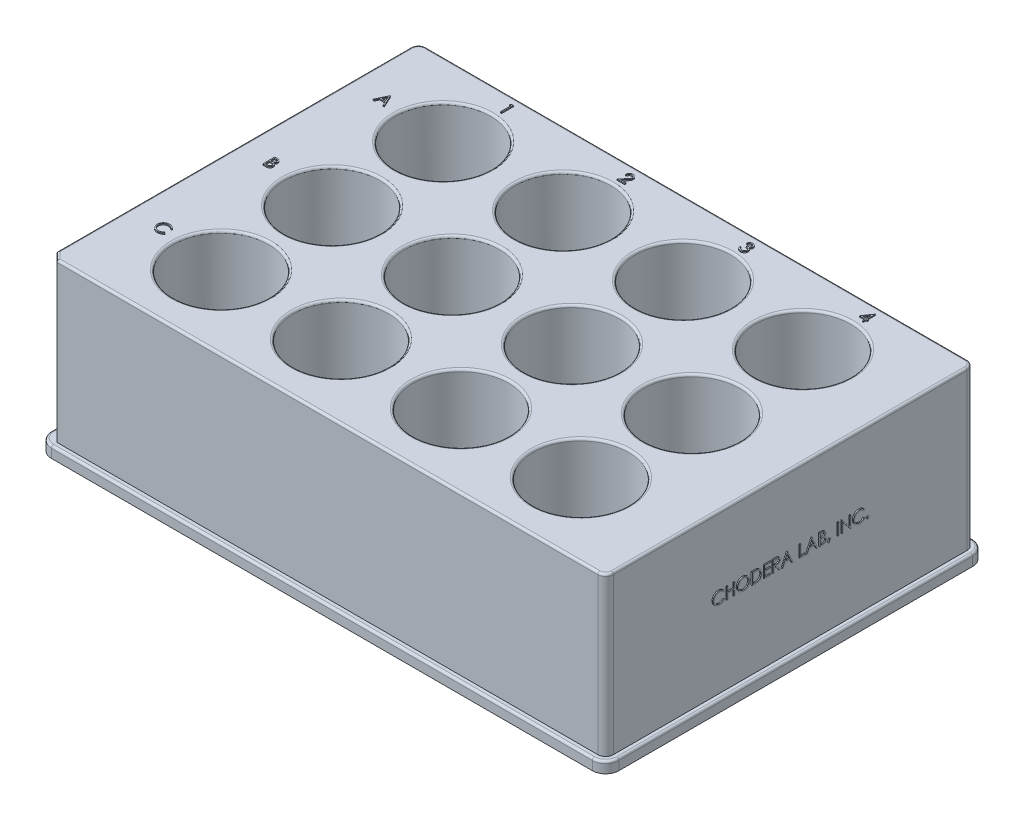
from build123d import *

# Parameters (mm, degrees)
SKETCH1_W           = 127.75
SKETCH1_H           = 85.6
BOSS_EXTRUDE1_DEPTH = 38.1
FILLET1_R           = 3
CUT_EXTRUDE2_DEPTH  = 35.6
SKETCH5_R           = 10.75
CUT_EXTRUDE3_DEPTH  = 35.6
FILLET3_R           = 0.5
FILLET5_R           = 0.5
SHELL1_T            = -1
BOSS_EXTRUDE2_DEPTH = 0.25
SKETCH8_W           = 10.375
SKETCH8_H           = 1
SKETCH8_W_2         = 1
SKETCH8_H_2         = 4.8
SKETCH8_W_3         = 5.5
SKETCH8_H_3         = 3.5
EXTRUDE_THIN2_DEPTH = 25.4
SKETCH10_W          = 0.237446581
SKETCH10_H          = 2.645833333
BOSS_EXTRUDE3_DEPTH = 0.25


with BuildPart() as part:
    # Sketch1 → Boss-Extrude1 (new body)
    with BuildSketch(Plane(origin=(0, 0, 0), x_dir=(1, 0, 0), z_dir=(0, 1, 0))):
        Rectangle(SKETCH1_W, SKETCH1_H)
    extrude(amount=BOSS_EXTRUDE1_DEPTH)

    # Fillet1
    fillet1_edges = [part.edges().sort_by_distance(p)[0] for p in [
        (-63.875, 19.05, -42.8),
        (63.875, 19.05, -42.8),
        (63.875, 19.05, 42.8),
        (-63.875, 19.05, 42.8),
    ]]
    fillet(fillet1_edges, radius=FILLET1_R)

    # Sketch3 → Cut-Extrude2 (cut)
    with BuildSketch(Plane(origin=(0, 38.1, 0), x_dir=(1, 0, 0), z_dir=(0, 1, 0))):
        with BuildLine():
            Line((-63.875, 39.8), (-63.875, -39.8))
            ThreePointArc((-63.875, -39.8), (-62.996320344, -41.921320344), (-60.875, -42.8))
            Line((-60.875, -42.8), (60.875, -42.8))
            ThreePointArc((60.875, -42.8), (62.996320344, -41.921320344), (63.875, -39.8))
            Line((63.875, -39.8), (63.875, 39.8))
            ThreePointArc((63.875, 39.8), (62.996320344, 41.921320344), (60.875, 42.8))
            Line((60.875, 42.8), (-60.875, 42.8))
            ThreePointArc((-60.875, 42.8), (-62.996320344, 41.921320344), (-63.875, 39.8))
        make_face()
        with BuildLine():
            Line((-62.625, 39.8), (-62.625, -39.8))
            Line((-62.625, -39.8), (-60.875, -41.55))
            Line((-60.875, -41.55), (60.875, -41.55))
            ThreePointArc((60.875, -41.55), (62.112436867, -41.037436867), (62.625, -39.8))
            Line((62.625, -39.8), (62.625, 39.8))
            ThreePointArc((62.625, 39.8), (62.112436867, 41.037436867), (60.875, 41.55))
            Line((60.875, 41.55), (-60.875, 41.55))
            ThreePointArc((-60.875, 41.55), (-62.112436867, 41.037436867), (-62.625, 39.8))
        make_face(mode=Mode.SUBTRACT)
    extrude(amount=-CUT_EXTRUDE2_DEPTH, mode=Mode.SUBTRACT)

    # Sketch5 → Cut-Extrude3 (cut)
    with BuildSketch(Plane(origin=(0, 38.1, 0), x_dir=(1, 0, 0), z_dir=(0, 1, 0))):
        with Locations(Location((-40.5, 25, 0), (0, 0, 270))):
            Circle(SKETCH5_R)
        with Locations(Location((-13.5, 25, 0), (0, 0, 270))):
            Circle(SKETCH5_R)
        with Locations(Location((-13.5, 0, 0), (0, 0, 270))):
            Circle(SKETCH5_R)
        with Locations(Location((-13.5, -25, 0), (0, 0, 270))):
            Circle(SKETCH5_R)
        with Locations(Location((-40.5, 0, 0), (0, 0, 270))):
            Circle(SKETCH5_R)
        with Locations(Location((-40.5, -25, 0), (0, 0, 270))):
            Circle(SKETCH5_R)
        with Locations(Location((40.5, -25, 0), (0, 0, 90))):
            Circle(SKETCH5_R)
        with Locations(Location((40.5, 0, 0), (0, 0, 90))):
            Circle(SKETCH5_R)
        with Locations(Location((13.5, -25, 0), (0, 0, 90))):
            Circle(SKETCH5_R)
        with Locations(Location((13.5, 0, 0), (0, 0, 90))):
            Circle(SKETCH5_R)
        with Locations(Location((13.5, 25, 0), (0, 0, 90))):
            Circle(SKETCH5_R)
        with Locations(Location((40.5, 25, 0), (0, 0, 90))):
            Circle(SKETCH5_R)
    extrude(amount=-CUT_EXTRUDE3_DEPTH, mode=Mode.SUBTRACT)

    # Fillet3
    fillet3_edges = [part.edges().sort_by_distance(p)[0] for p in [
        (-40.5, 2.5, -10.75),
        (-40.5, 38.1, -10.75),
        (-40.5, 2.5, 14.25),
        (-40.5, 38.1, 14.25),
        (40.5, 2.5, 10.75),
        (40.5, 38.1, 10.75),
        (13.5, 2.5, 35.75),
        (13.5, 38.1, 35.75),
        (13.5, 2.5, 10.75),
        (13.5, 38.1, 10.75),
        (13.5, 2.5, -14.25),
        (13.5, 38.1, -14.25),
        (40.5, 2.5, -14.25),
        (40.5, 38.1, -14.25),
        (-62.112436867, 38.1, -41.037436867),
        (0, 38.1, -41.55),
        (62.112436867, 38.1, -41.037436867),
        (62.625, 38.1, 0),
        (62.112436867, 38.1, 41.037436867),
        (0, 38.1, 41.55),
        (-61.75, 38.1, 40.675),
        (-62.625, 38.1, 0),
        (-40.5, 2.5, -35.75),
        (-40.5, 38.1, -35.75),
        (40.5, 2.5, 35.75),
        (40.5, 38.1, 35.75),
        (-13.5, 2.5, -35.75),
        (-13.5, 38.1, -35.75),
        (-13.5, 2.5, -10.75),
        (-13.5, 38.1, -10.75),
        (-13.5, 2.5, 14.25),
        (-13.5, 38.1, 14.25),
    ]]
    fillet(fillet3_edges, radius=FILLET3_R)

    # Fillet5
    fillet5_edges = [part.edges().sort_by_distance(p)[0] for p in [
        (-62.996320344, 2.5, -41.921320344),
        (0, 2.5, -42.8),
        (62.996320344, 2.5, -41.921320344),
        (63.875, 2.5, 0),
        (62.996320344, 2.5, 41.921320344),
        (0, 2.5, 42.8),
        (-62.996320344, 2.5, 41.921320344),
        (-63.875, 2.5, 0),
    ]]
    fillet(fillet5_edges, radius=FILLET5_R)

    # Shell1
    shell1_openings = [part.faces().sort_by_distance(p)[0] for p in [
        (0, 0, 0),
    ]]
    offset(amount=SHELL1_T, openings=shell1_openings, kind=Kind.INTERSECTION)

    # Sketch6 → Boss-Extrude2 (add)
    # profile 1 of 7: a face of its own
    with BuildSketch(Plane(origin=(0, 38.1, 0), x_dir=(1, 0, 0), z_dir=(0, 1, 0))):
        Polygon((-55.075320513, 27.749386724), (-53.854166667, 25.103553391), (-54.112283821, 25.103553391), (-54.503434662, 25.951576895), (-55.702857906, 25.951576895), (-56.105139056, 25.103553391), (-56.364316239, 25.103553391), (-55.109241453, 27.749386724), align=None)
        Polygon((-55.094931056, 27.23368243), (-55.574064336, 26.222944416), (-54.628518129, 26.222944416), align=None, mode=Mode.SUBTRACT)
    # profile 2 of 7: a face of its own
    with BuildSketch(Plane(origin=(0, 38.1, 0), x_dir=(1, 0, 0), z_dir=(0, 1, 0))):
        with BuildLine():
            Line((-56.160790598, 2.744698693), (-55.64455629, 2.744698693))
            add(Edge.make_bspline(
                [(-55.64455629, 2.744698693), (-55.619285952, 2.744565834), (-55.570305749, 2.744308321), (-55.499080337, 2.740314525), (-55.432368439, 2.734868894), (-55.370150706, 2.726228288), (-55.312455889, 2.715802361), (-55.259110116, 2.703176583), (-55.210283022, 2.688037417), (-55.151989465, 2.663963145), (-55.085525632, 2.628189083), (-55.01356018, 2.575326418), (-54.952022452, 2.510667949), (-54.898964938, 2.437731656), (-54.856781949, 2.357498066), (-54.826264682, 2.271879513), (-54.806944146, 2.181980339), (-54.804957175, 2.120261984), (-54.803952991, 2.089070521)],
                knots=[0, 0, 0, 0, 1.001505555, 1.941167018, 2.826882275, 3.653841531, 4.429895133, 5.150066043, 5.825578002, 6.45369114, 7.647487171, 8.808567382, 9.977351308, 11.170798116, 12.373658725, 13.556498008, 14.765093433, 16, 16, 16, 16], degree=3))
            add(Edge.make_bspline(
                [(-54.803952991, 2.089070521), (-54.804779413, 2.05985103), (-54.806403408, 2.002431974), (-54.821932756, 1.918450117), (-54.84624469, 1.838507232), (-54.880039729, 1.762895071), (-54.923962072, 1.693322042), (-54.976015681, 1.629226906), (-55.038817788, 1.573323429), (-55.085870714, 1.542070163), (-55.109771468, 1.52619492)],
                knots=[0, 0, 0, 0, 1.044552857, 2.05264487, 3.044412934, 4.028983338, 5.005914585, 5.980388656, 6.974128949, 8, 8, 8, 8], degree=3))
            add(Edge.make_bspline(
                [(-55.109771468, 1.52619492), (-55.079714478, 1.514655308), (-55.02220801, 1.492577171), (-54.94307037, 1.453543219), (-54.874887362, 1.411087338), (-54.817134758, 1.36472338), (-54.767742602, 1.314748267), (-54.724613295, 1.260429222), (-54.687812494, 1.201057661), (-54.65627951, 1.137252608), (-54.631674201, 1.069665575), (-54.613247178, 0.998930524), (-54.602688451, 0.925301099), (-54.601185889, 0.875192508), (-54.60042735, 0.849896176)],
                knots=[0, 0, 0, 0, 1.27268992, 2.434971085, 3.483601985, 4.442670788, 5.356604649, 6.2567628, 7.179492994, 8.113709626, 9.066344395, 10.018646069, 10.999752585, 12, 12, 12, 12], degree=3))
            add(Edge.make_bspline(
                [(-54.60042735, 0.849896176), (-54.6011658, 0.824067647), (-54.602618719, 0.773249294), (-54.613338102, 0.698595115), (-54.631487844, 0.62725215), (-54.656488056, 0.558758946), (-54.68911671, 0.493248011), (-54.72882535, 0.430645127), (-54.776171829, 0.371579294), (-54.829136022, 0.315394174), (-54.88905443, 0.264875549), (-54.953700268, 0.219884509), (-55.023887665, 0.182883617), (-55.098463875, 0.151801862), (-55.178265471, 0.128059516), (-55.262934108, 0.111449296), (-55.352396765, 0.100257393), (-55.41378747, 0.099337244), (-55.445270767, 0.09886536)],
                knots=[0, 0, 0, 0, 0.978564426, 1.925352924, 2.850884081, 3.763762016, 4.682927383, 5.618979971, 6.567305752, 7.547517671, 8.540179244, 9.531824382, 10.526200242, 11.540722885, 12.589160233, 13.674978461, 14.80764778, 16, 16, 16, 16], degree=3))
            Line((-55.445270767, 0.09886536), (-56.160790598, 0.09886536))
            Line((-56.160790598, 0.09886536), (-56.160790598, 2.744698693))
        make_face()
        with BuildLine():
            Line((-55.923344017, 2.473331172), (-55.923344017, 1.625307668))
            Line((-55.923344017, 1.625307668), (-55.763809595, 1.625307668))
            add(Edge.make_bspline(
                [(-55.763809595, 1.625307668), (-55.740489375, 1.62560999), (-55.695429957, 1.626194139), (-55.630176226, 1.627867453), (-55.569605527, 1.632552879), (-55.513822416, 1.637236958), (-55.462914735, 1.644852866), (-55.416995268, 1.65391834), (-55.375343352, 1.663506012), (-55.327310482, 1.679811517), (-55.272826765, 1.703909522), (-55.214744597, 1.741307874), (-55.163540563, 1.785851879), (-55.120302213, 1.837249809), (-55.08491497, 1.89384508), (-55.06033615, 1.954734686), (-55.043669453, 2.018401095), (-55.04216395, 2.062108941), (-55.041399573, 2.084300389)],
                knots=[0, 0, 0, 0, 1.156816544, 2.235205308, 3.236616184, 4.169592532, 5.011045266, 5.787822928, 6.49130361, 7.128639758, 8.301311294, 9.436451833, 10.541879658, 11.654887649, 12.756523258, 13.837046038, 14.901820046, 16, 16, 16, 16], degree=3))
            add(Edge.make_bspline(
                [(-55.041399573, 2.084300389), (-55.04179734, 2.098985347), (-55.042577604, 2.127791497), (-55.048967898, 2.169784163), (-55.0598291, 2.209277952), (-55.073779667, 2.246814095), (-55.093274687, 2.281218887), (-55.11622802, 2.313681898), (-55.143960655, 2.343097606), (-55.175527195, 2.370591215), (-55.211819427, 2.394966543), (-55.252815702, 2.416315215), (-55.299070672, 2.433506159), (-55.349804794, 2.448561822), (-55.405799009, 2.459136306), (-55.466407154, 2.467945712), (-55.532125662, 2.472430583), (-55.577592495, 2.47302428), (-55.601095085, 2.473331172)],
                knots=[0, 0, 0, 0, 0.91205012, 1.789085906, 2.630437955, 3.453916878, 4.269457761, 5.079663411, 5.91843418, 6.774407191, 7.675494373, 8.627863946, 9.638891023, 10.736472738, 11.911756761, 13.175263542, 14.539845004, 16, 16, 16, 16], degree=3))
            Line((-55.601095085, 2.473331172), (-55.923344017, 2.473331172))
        make_face(mode=Mode.SUBTRACT)
        with BuildLine():
            Line((-55.923344017, 1.353940146), (-55.923344017, 0.370232881))
            Line((-55.923344017, 0.370232881), (-55.585194645, 0.370232881))
            add(Edge.make_bspline(
                [(-55.585194645, 0.370232881), (-55.560989861, 0.370522976), (-55.514338333, 0.371082095), (-55.446982046, 0.372907384), (-55.384553152, 0.377059283), (-55.327336525, 0.383595133), (-55.274714338, 0.390684794), (-55.22731786, 0.400218322), (-55.184762886, 0.411141048), (-55.135418618, 0.428024619), (-55.079853466, 0.454253499), (-55.01997383, 0.493800563), (-54.966734963, 0.540914015), (-54.921525035, 0.595441552), (-54.88447355, 0.6547319), (-54.857519723, 0.717585825), (-54.840895683, 0.782964766), (-54.83888321, 0.827540793), (-54.837873932, 0.849896176)],
                knots=[0, 0, 0, 0, 1.160039823, 2.235823828, 3.228722157, 4.157150951, 4.99529583, 5.772374946, 6.472645482, 7.099169577, 8.269452708, 9.405989375, 10.527446681, 11.663510218, 12.788923519, 13.866172445, 14.929861265, 16, 16, 16, 16], degree=3))
            add(Edge.make_bspline(
                [(-54.837873932, 0.849896176), (-54.838082653, 0.863876261), (-54.83849673, 0.89161093), (-54.844741362, 0.932368722), (-54.853823275, 0.971848995), (-54.8655643, 1.010158954), (-54.88266354, 1.046605971), (-54.90262563, 1.081910882), (-54.926030975, 1.116120357), (-54.962501267, 1.159370096), (-55.015547946, 1.209200219), (-55.090921521, 1.257987498), (-55.176625579, 1.297333161), (-55.238785648, 1.314039313), (-55.270895933, 1.322669279)],
                knots=[0, 0, 0, 0, 0.723448775, 1.435228256, 2.130040452, 2.821711965, 3.505591119, 4.210454504, 4.921174351, 5.648778258, 7.137944449, 8.670945889, 10.280296675, 12, 12, 12, 12], degree=3))
            add(Edge.make_bspline(
                [(-55.270895933, 1.322669279), (-55.283769119, 1.325281158), (-55.311680841, 1.330944251), (-55.357194904, 1.336922098), (-55.409155948, 1.342247828), (-55.467683957, 1.346187215), (-55.532852979, 1.350259185), (-55.604802198, 1.35184277), (-55.683237787, 1.353732092), (-55.737660592, 1.353869021), (-55.765929654, 1.353940146)],
                knots=[0, 0, 0, 0, 0.634451884, 1.375622551, 2.216452059, 3.157844607, 4.20941857, 5.370758133, 6.634282058, 8, 8, 8, 8], degree=3))
            Line((-55.765929654, 1.353940146), (-55.923344017, 1.353940146))
        make_face(mode=Mode.SUBTRACT)
    # profile 3 of 7: a face of its own
    with BuildSketch(Plane(origin=(0, 38.1, 0), x_dir=(1, 0, 0), z_dir=(0, 1, 0))):
        with BuildLine():
            Line((-53.718482906, -22.736106732), (-53.926248665, -22.895111139))
            add(Edge.make_bspline(
                [(-53.926248665, -22.895111139), (-53.941069783, -22.877447579), (-53.970512198, -22.842358601), (-54.017879571, -22.793085969), (-54.067244503, -22.746923539), (-54.118588125, -22.703651404), (-54.172834602, -22.664782778), (-54.228669849, -22.628292122), (-54.287027895, -22.595583773), (-54.367727123, -22.555924254), (-54.473294246, -22.514538767), (-54.606186773, -22.47983811), (-54.744912425, -22.457748293), (-54.839555849, -22.455355824), (-54.887695313, -22.454138917)],
                knots=[0, 0, 0, 0, 0.757959112, 1.505699292, 2.245454638, 2.979532153, 3.711538275, 4.438200793, 5.171680507, 5.909471876, 7.393775596, 8.890124382, 10.418191784, 12, 12, 12, 12], degree=3))
            add(Edge.make_bspline(
                [(-54.887695313, -22.454138917), (-54.914216616, -22.454444294), (-54.967013081, -22.455052212), (-55.045366391, -22.463072206), (-55.122256614, -22.47434437), (-55.197633735, -22.491070061), (-55.271401804, -22.512216029), (-55.344043085, -22.53748405), (-55.414505859, -22.56874634), (-55.483764885, -22.603299608), (-55.550121788, -22.642327498), (-55.612907449, -22.68489771), (-55.671892878, -22.730533872), (-55.727124733, -22.77940703), (-55.77865948, -22.831297084), (-55.826123697, -22.886757032), (-55.869353144, -22.945609568), (-55.909204705, -23.007078632), (-55.944895283, -23.070985177), (-55.974777989, -23.137565736), (-56.001240195, -23.205680148), (-56.022179503, -23.276097989), (-56.038753394, -23.348323771), (-56.050189187, -23.422551331), (-56.058117972, -23.4986256), (-56.058722867, -23.550188593), (-56.059027778, -23.576180016)],
                knots=[0, 0, 0, 0, 1.054917814, 2.100044995, 3.131103042, 4.146048494, 5.169673617, 6.183595914, 7.203665975, 8.234915748, 9.262203917, 10.264457458, 11.251630812, 12.227803204, 13.197192746, 14.159520551, 15.12972552, 16.100847026, 17.073214652, 18.039054194, 19.002613845, 19.979014051, 20.95965708, 21.949030935, 22.966165397, 24, 24, 24, 24], degree=3))
            add(Edge.make_bspline(
                [(-56.059027778, -23.576180016), (-56.058073903, -23.615286431), (-56.056201095, -23.692066688), (-56.039533605, -23.804530186), (-56.014205351, -23.912269028), (-55.976244766, -24.014609742), (-55.929436913, -24.112814275), (-55.870290736, -24.205221027), (-55.801788949, -24.293226406), (-55.722962453, -24.374750539), (-55.636477104, -24.449222225), (-55.543685528, -24.514801533), (-55.444818834, -24.569468141), (-55.340968644, -24.614958291), (-55.231335808, -24.649926174), (-55.116117475, -24.674543101), (-54.99556424, -24.690601178), (-54.913188563, -24.692138549), (-54.871264857, -24.692920968)],
                knots=[0, 0, 0, 0, 1.029171465, 2.020641659, 2.987623507, 3.938342917, 4.889210282, 5.84687017, 6.821220943, 7.821438502, 8.827599549, 9.822697543, 10.807740252, 11.797342354, 12.80366471, 13.83203677, 14.896651826, 16, 16, 16, 16], degree=3))
            add(Edge.make_bspline(
                [(-54.871264857, -24.692920968), (-54.825074134, -24.691644331), (-54.734159741, -24.689131604), (-54.600833911, -24.667844553), (-54.473202112, -24.633329341), (-54.351257478, -24.585025555), (-54.235343788, -24.522232152), (-54.125279646, -24.446109352), (-54.020972149, -24.355933053), (-53.95824981, -24.287078545), (-53.926248665, -24.251948746)],
                knots=[0, 0, 0, 0, 1.028121516, 2.023589091, 2.998037872, 3.967518031, 4.937445131, 5.927275754, 6.942489185, 8, 8, 8, 8], degree=3))
            Line((-53.926248665, -24.251948746), (-53.718482906, -24.409363109))
            add(Edge.make_bspline(
                [(-53.718482906, -24.409363109), (-53.735203144, -24.43093682), (-53.76856353, -24.473980904), (-53.822582389, -24.534662494), (-53.879488441, -24.59173995), (-53.939704364, -24.644753092), (-54.002537457, -24.694762718), (-54.069115931, -24.740348031), (-54.138564545, -24.782145306), (-54.21064799, -24.820416851), (-54.28528968, -24.85437215), (-54.362400175, -24.883441368), (-54.441647098, -24.908482207), (-54.523034072, -24.929083373), (-54.606729912, -24.9451633), (-54.692432592, -24.955912697), (-54.780327081, -24.96327712), (-54.83962506, -24.963948342), (-54.869674813, -24.96428849)],
                knots=[0, 0, 0, 0, 0.986787822, 1.968848986, 2.935600012, 3.899624008, 4.868462664, 5.837806735, 6.815139263, 7.798259679, 8.787526145, 9.778297419, 10.776456485, 11.791383307, 12.812564526, 13.85620153, 14.913611965, 16, 16, 16, 16], degree=3))
            add(Edge.make_bspline(
                [(-54.869674813, -24.96428849), (-54.898131633, -24.964090436), (-54.95440147, -24.963698809), (-55.037479693, -24.95735473), (-55.118358721, -24.948699274), (-55.196807397, -24.935666556), (-55.273253818, -24.920287204), (-55.347004974, -24.899671432), (-55.418786592, -24.876577717), (-55.488310278, -24.849435257), (-55.55563517, -24.818806952), (-55.620544123, -24.784190714), (-55.683007283, -24.745877638), (-55.743638762, -24.704712243), (-55.801542888, -24.659372259), (-55.857221445, -24.610487363), (-55.910986651, -24.558222319), (-55.944250585, -24.520534424), (-55.96097506, -24.501585665)],
                knots=[0, 0, 0, 0, 1.114604814, 2.203992996, 3.262667896, 4.300477797, 5.318619304, 6.316056647, 7.298880507, 8.271930387, 9.238335007, 10.195173496, 11.151986948, 12.108099108, 13.064862484, 14.031167946, 15.010108607, 16, 16, 16, 16], degree=3))
            add(Edge.make_bspline(
                [(-55.96097506, -24.501585665), (-55.987762719, -24.4686706), (-56.041014633, -24.403237848), (-56.109145358, -24.297188327), (-56.167465236, -24.186465336), (-56.214618462, -24.070487175), (-56.251480766, -23.949514091), (-56.277017741, -23.823485101), (-56.293612109, -23.692517906), (-56.295509768, -23.603438905), (-56.296474359, -23.558159517)],
                knots=[0, 0, 0, 0, 0.994628077, 1.977248131, 2.950237994, 3.925870899, 4.908910175, 5.911660606, 6.938484602, 8, 8, 8, 8], degree=3))
            add(Edge.make_bspline(
                [(-56.296474359, -23.558159517), (-56.295298707, -23.510568192), (-56.292985684, -23.416935231), (-56.273334101, -23.279522778), (-56.241721082, -23.147872614), (-56.196819863, -23.022230497), (-56.139892603, -22.901935583), (-56.069568913, -22.787906815), (-55.986665776, -22.679414948), (-55.891833388, -22.578106178), (-55.787839034, -22.485472263), (-55.676473025, -22.403975906), (-55.557953339, -22.336153737), (-55.433585678, -22.279460209), (-55.302438764, -22.23588374), (-55.164792407, -22.205378652), (-55.020905251, -22.186391308), (-54.922735442, -22.183991002), (-54.872854901, -22.182771396)],
                knots=[0, 0, 0, 0, 1.032925535, 2.032216505, 3.007276963, 3.968222605, 4.92396291, 5.891752235, 6.871517503, 7.883894988, 8.900124299, 9.891468569, 10.874487609, 11.85992873, 12.854644235, 13.869047385, 14.917252991, 16, 16, 16, 16], degree=3))
            add(Edge.make_bspline(
                [(-54.872854901, -22.182771396), (-54.842454675, -22.183135869), (-54.78228049, -22.183857308), (-54.693265092, -22.190892308), (-54.606600952, -22.202619856), (-54.522228364, -22.218582599), (-54.439736863, -22.238394086), (-54.359756919, -22.264202526), (-54.281819221, -22.293712285), (-54.206415308, -22.327698744), (-54.133906964, -22.365849197), (-54.064316771, -22.40774077), (-53.998197502, -22.453321528), (-53.935083909, -22.502203809), (-53.876031773, -22.555421768), (-53.819364465, -22.611511617), (-53.767006388, -22.672088972), (-53.734687008, -22.714728416), (-53.718482906, -22.736106732)],
                knots=[0, 0, 0, 0, 1.096760587, 2.17092713, 3.219439832, 4.250915756, 5.268269357, 6.278326846, 7.281116186, 8.274029601, 9.260640565, 10.235837813, 11.203064059, 12.156899882, 13.114053108, 14.069676657, 15.032185724, 16, 16, 16, 16], degree=3))
        make_face()
    # profile 4 of 7: a face of its own
    with BuildSketch(Plane(origin=(0, 38.1, 0), x_dir=(1, 0, 0), z_dir=(0, 1, 0))):
        Polygon((-39.835891593, 39.645833333), (-39.346688034, 39.645833333), (-39.346688034, 37), (-39.584134615, 37), (-39.584134615, 39.374465812), (-39.991185897, 39.374465812), align=None)
    # profile 5 of 7: a face of its own
    with BuildSketch(Plane(origin=(0, 38.1, 0), x_dir=(1, 0, 0), z_dir=(0, 1, 0))):
        with BuildLine():
            Line((-13.059027778, 38.831730769), (-13.296474359, 38.831730769))
            add(Edge.make_bspline(
                [(-13.296474359, 38.831730769), (-13.294926809, 38.863231976), (-13.291887461, 38.925099508), (-13.277654171, 39.015302699), (-13.257288151, 39.101522696), (-13.228492826, 39.183067214), (-13.192731532, 39.260657265), (-13.149846333, 39.333984658), (-13.099050982, 39.402769663), (-13.04144232, 39.466374622), (-12.97887317, 39.52472475), (-12.911362132, 39.57511294), (-12.840419761, 39.617686417), (-12.766261286, 39.653277594), (-12.688050027, 39.679992835), (-12.606495724, 39.699815146), (-12.521240067, 39.711741312), (-12.463152669, 39.713023245), (-12.433610443, 39.713675214)],
                knots=[0, 0, 0, 0, 1.10065271, 2.161652631, 3.183658789, 4.190468796, 5.17591951, 6.163126047, 7.15150782, 8.156236427, 9.156009102, 10.134482811, 11.092018607, 12.041330605, 13.001268258, 13.972401359, 14.968799086, 16, 16, 16, 16], degree=3))
            add(Edge.make_bspline(
                [(-12.433610443, 39.713675214), (-12.404598447, 39.712996023), (-12.34759091, 39.711661439), (-12.264389268, 39.700200423), (-12.185182623, 39.682249886), (-12.1101258, 39.657065018), (-12.039817644, 39.623210123), (-11.973729985, 39.582541746), (-11.911076039, 39.535506516), (-11.854676863, 39.480130121), (-11.802888017, 39.421012843), (-11.758209527, 39.357899963), (-11.719948385, 39.292714729), (-11.688056508, 39.224960077), (-11.664579546, 39.15399805), (-11.646755544, 39.080861771), (-11.636680654, 39.004794206), (-11.635134411, 38.953308893), (-11.634348291, 38.927133413)],
                knots=[0, 0, 0, 0, 1.111607364, 2.184268762, 3.212621178, 4.221274766, 5.211760367, 6.196651075, 7.1921475, 8.207485113, 9.220403448, 10.201281604, 11.166441695, 12.114753415, 13.065576456, 14.026450734, 14.996634279, 16, 16, 16, 16], degree=3))
            add(Edge.make_bspline(
                [(-11.634348291, 38.927133413), (-11.635628317, 38.890282372), (-11.638165906, 38.817226972), (-11.659872608, 38.709870499), (-11.693774434, 38.605856426), (-11.734593865, 38.522144299), (-11.775772439, 38.454688027), (-11.812880257, 38.399149184), (-11.856320918, 38.339349217), (-11.906726687, 38.275488373), (-11.96305487, 38.207066438), (-12.025815672, 38.134124748), (-12.095456638, 38.057416922), (-12.144335385, 38.005025188), (-12.169663128, 37.977877103)],
                knots=[0, 0, 0, 0, 1.184426356, 2.348067706, 3.509069118, 4.696110526, 5.333549288, 6.050745305, 6.844228056, 7.710549037, 8.667450064, 9.695053472, 10.805634456, 12, 12, 12, 12], degree=3))
            Line((-12.169663128, 37.977877103), (-12.831651476, 37.271367521))
            Line((-12.831651476, 37.271367521), (-11.60042735, 37.271367521))
            Line((-11.60042735, 37.271367521), (-11.60042735, 37))
            Line((-11.60042735, 37), (-13.398237179, 37))
            Line((-13.398237179, 37), (-12.372128739, 38.09501035))
            add(Edge.make_bspline(
                [(-12.372128739, 38.09501035), (-12.347146111, 38.121089427), (-12.299159594, 38.171181997), (-12.231288241, 38.244315068), (-12.170329006, 38.312161447), (-12.115887286, 38.374592945), (-12.069144101, 38.432522761), (-12.027663306, 38.484074709), (-11.994427413, 38.531514085), (-11.958356846, 38.586502526), (-11.923421277, 38.653640408), (-11.893400627, 38.735686709), (-11.875095354, 38.820147192), (-11.872899437, 38.877223136), (-11.871794872, 38.905932826)],
                knots=[0, 0, 0, 0, 1.329631726, 2.553950428, 3.673215718, 4.687767853, 5.603093632, 6.413772471, 7.123043292, 7.734684054, 8.834405432, 9.900288307, 10.943827018, 12, 12, 12, 12], degree=3))
            add(Edge.make_bspline(
                [(-11.871794872, 38.905932826), (-11.872275463, 38.923986026), (-11.873222615, 38.959565416), (-11.881581708, 39.011730484), (-11.894214055, 39.062050314), (-11.91231553, 39.110679686), (-11.93620872, 39.157129673), (-11.965292763, 39.201456816), (-11.998849537, 39.244310974), (-12.037668652, 39.284492337), (-12.080313074, 39.32129301), (-12.125363489, 39.353892765), (-12.173026366, 39.381136616), (-12.223100744, 39.403470093), (-12.275447021, 39.420989578), (-12.330166442, 39.433129099), (-12.387107811, 39.440750977), (-12.425989085, 39.441782226), (-12.445800781, 39.442307692)],
                knots=[0, 0, 0, 0, 0.991446411, 1.95395049, 2.89581595, 3.838931463, 4.798493298, 5.75982156, 6.748411868, 7.785213223, 8.824556874, 9.840280684, 10.836137867, 11.835679398, 12.848801643, 13.863922112, 14.911575587, 16, 16, 16, 16], degree=3))
            add(Edge.make_bspline(
                [(-12.445800781, 39.442307692), (-12.466491827, 39.441767162), (-12.507125626, 39.44070565), (-12.566784657, 39.433280183), (-12.623697119, 39.420469935), (-12.678006177, 39.402949473), (-12.729803721, 39.380680213), (-12.77883785, 39.352943001), (-12.824998486, 39.319844765), (-12.868372406, 39.282318868), (-12.908335056, 39.240539194), (-12.943446683, 39.193964995), (-12.974126265, 39.143446652), (-13.000893959, 39.089120473), (-13.022631892, 39.030493509), (-13.039242547, 38.967773875), (-13.052386175, 38.901233902), (-13.05677714, 38.855283272), (-13.059027778, 38.831730769)],
                knots=[0, 0, 0, 0, 1.031018746, 2.02475058, 2.990194455, 3.934040569, 4.864654155, 5.795059489, 6.735614925, 7.690564532, 8.649604399, 9.611025574, 10.590972636, 11.591080095, 12.624614302, 13.701020113, 14.821632451, 16, 16, 16, 16], degree=3))
        make_face()
    # profile 6 of 7: a face of its own
    with BuildSketch(Plane(origin=(0, 38.1, 0), x_dir=(1, 0, 0), z_dir=(0, 1, 0))):
        with BuildLine():
            Line((13.940972222, 39.03525641), (13.703525641, 39.03525641))
            add(Edge.make_bspline(
                [(13.703525641, 39.03525641), (13.709958456, 39.06189049), (13.722534083, 39.113957939), (13.748763797, 39.188349142), (13.777338234, 39.258746089), (13.811650235, 39.323830621), (13.849076496, 39.384910744), (13.891956172, 39.440601094), (13.938310963, 39.492318038), (13.989583395, 39.538214355), (14.043353276, 39.5797749), (14.100378256, 39.615210211), (14.159511039, 39.645693351), (14.221161324, 39.670806264), (14.285512656, 39.689724368), (14.351983264, 39.703450049), (14.420747339, 39.71236357), (14.467425577, 39.713233492), (14.491127471, 39.713675214)],
                knots=[0, 0, 0, 0, 1.162005537, 2.271625781, 3.343758855, 4.383309926, 5.390229558, 6.379919256, 7.361854164, 8.333198761, 9.295911338, 10.242430842, 11.177959212, 12.116337295, 13.062827104, 14.020064771, 14.994644689, 16, 16, 16, 16], degree=3))
            add(Edge.make_bspline(
                [(14.491127471, 39.713675214), (14.525661448, 39.712632581), (14.593976117, 39.710570059), (14.694338659, 39.691735932), (14.791120837, 39.661932409), (14.883263305, 39.620752865), (14.968851048, 39.569962456), (15.045002808, 39.509512923), (15.110686385, 39.440570594), (15.165791063, 39.364421572), (15.208937045, 39.283039133), (15.240752339, 39.199279491), (15.26012111, 39.113341334), (15.262631293, 39.055316486), (15.263888889, 39.026246161)],
                knots=[0, 0, 0, 0, 1.083050992, 2.142477498, 3.193116406, 4.255571735, 5.30263384, 6.308962982, 7.297363603, 8.282367274, 9.249857812, 10.179914175, 11.08814088, 12, 12, 12, 12], degree=3))
            add(Edge.make_bspline(
                [(15.263888889, 39.026246161), (15.263009269, 38.998270786), (15.261287991, 38.943527319), (15.24667263, 38.863606902), (15.222076765, 38.788282597), (15.18800617, 38.717237313), (15.143902736, 38.650921512), (15.090477543, 38.589185987), (15.027353507, 38.531756921), (14.979517643, 38.498858272), (14.954890325, 38.481921074)],
                knots=[0, 0, 0, 0, 1.024540389, 2.004866551, 2.965041327, 3.920577974, 4.882998113, 5.874504559, 6.905732034, 8, 8, 8, 8], degree=3))
            add(Edge.make_bspline(
                [(14.954890325, 38.481921074), (14.983035758, 38.468330432), (15.038800002, 38.44140344), (15.114811414, 38.388595814), (15.183813142, 38.327623456), (15.222293929, 38.280041808), (15.241628272, 38.256134816)],
                knots=[0, 0, 0, 0, 1.015518401, 2.012035669, 3.001164323, 4, 4, 4, 4], degree=3))
            add(Edge.make_bspline(
                [(15.241628272, 38.256134816), (15.254359525, 38.238704253), (15.279613547, 38.204128567), (15.310785647, 38.14853853), (15.339065156, 38.092332345), (15.361101334, 38.034003508), (15.378166102, 37.974228075), (15.390364174, 37.912903407), (15.397941948, 37.849979426), (15.399027157, 37.807409872), (15.39957265, 37.786011786)],
                knots=[0, 0, 0, 0, 1.025084078, 2.033381695, 3.024893161, 4.013698104, 4.991890475, 5.976764909, 6.982997093, 8, 8, 8, 8], degree=3))
            add(Edge.make_bspline(
                [(15.39957265, 37.786011786), (15.398216083, 37.74896277), (15.395509333, 37.675039093), (15.371315777, 37.565823083), (15.33381053, 37.459063328), (15.280548441, 37.356953182), (15.215636693, 37.261415632), (15.138410621, 37.175935327), (15.049747681, 37.10245781), (14.95086484, 37.041066745), (14.843733439, 36.991991887), (14.729149509, 36.957930606), (14.608764052, 36.935746428), (14.526208535, 36.933367545), (14.48423728, 36.93215812)],
                knots=[0, 0, 0, 0, 0.955779014, 1.907060117, 2.875433937, 3.871313158, 4.872415639, 5.851225146, 6.836215519, 7.83643374, 8.849228613, 9.86973379, 10.916971861, 12, 12, 12, 12], degree=3))
            add(Edge.make_bspline(
                [(14.48423728, 36.93215812), (14.455950071, 36.932814448), (14.400290276, 36.934105882), (14.318463345, 36.942934348), (14.240357061, 36.959058817), (14.165865817, 36.980757149), (14.094923438, 37.008267573), (14.027746406, 37.04252635), (13.963921427, 37.082827307), (13.904050792, 37.12964615), (13.848141636, 37.182019544), (13.797679756, 37.240877248), (13.751823841, 37.305131238), (13.711801727, 37.375527834), (13.675790459, 37.451157284), (13.646171522, 37.532987995), (13.620102074, 37.620288416), (13.607981538, 37.681125755), (13.601762821, 37.712339744)],
                knots=[0, 0, 0, 0, 1.048658725, 2.063410685, 3.046034179, 4.001477787, 4.936774919, 5.862367409, 6.792675028, 7.730719943, 8.675894397, 9.627829632, 10.600096036, 11.597688215, 12.626045268, 13.701542398, 14.82072376, 16, 16, 16, 16], degree=3))
            Line((13.601762821, 37.712339744), (13.839209402, 37.712339744))
            add(Edge.make_bspline(
                [(13.839209402, 37.712339744), (13.84539558, 37.691967573), (13.857428235, 37.652341931), (13.877910234, 37.595312653), (13.901245178, 37.543032458), (13.926278207, 37.495117836), (13.952569057, 37.451096912), (13.981986887, 37.412133714), (14.012352848, 37.376516864), (14.035242597, 37.356450402), (14.046445146, 37.346629607)],
                knots=[0, 0, 0, 0, 1.198163088, 2.33053128, 3.407730985, 4.417276592, 5.372219308, 6.28897303, 7.162600585, 8, 8, 8, 8], degree=3))
            add(Edge.make_bspline(
                [(14.046445146, 37.346629607), (14.061259224, 37.335208426), (14.090841654, 37.312401319), (14.1390474, 37.283295921), (14.18974526, 37.258076575), (14.244033734, 37.238812114), (14.300741329, 37.22250043), (14.360784635, 37.21182599), (14.423633924, 37.204502194), (14.46654765, 37.203855906), (14.488477397, 37.203525641)],
                knots=[0, 0, 0, 0, 0.946170439, 1.889420265, 2.845303464, 3.807233317, 4.801018734, 5.828864929, 6.890507805, 8, 8, 8, 8], degree=3))
            add(Edge.make_bspline(
                [(14.488477397, 37.203525641), (14.513237485, 37.203991236), (14.561653701, 37.204901667), (14.632301124, 37.213274374), (14.699510921, 37.225468198), (14.762536883, 37.244301227), (14.822204588, 37.267570085), (14.87767762, 37.296786439), (14.929684201, 37.331064889), (14.977558215, 37.370026039), (15.020606307, 37.412678003), (15.058509392, 37.457289074), (15.090731606, 37.50367116), (15.116723954, 37.55208093), (15.137248477, 37.602317918), (15.151220897, 37.654523105), (15.16093603, 37.708269252), (15.161727219, 37.744803651), (15.162126068, 37.763221154)],
                knots=[0, 0, 0, 0, 1.217147791, 2.380027433, 3.494444702, 4.572153297, 5.609568379, 6.639424714, 7.649109417, 8.668170816, 9.669597737, 10.625200337, 11.543417969, 12.441394052, 13.322311151, 14.205496177, 15.095365482, 16, 16, 16, 16], degree=3))
            add(Edge.make_bspline(
                [(15.162126068, 37.763221154), (15.160969233, 37.787873773), (15.158661319, 37.837056344), (15.141041143, 37.909414272), (15.112058788, 37.97913078), (15.071484925, 38.045016407), (15.022094225, 38.106079142), (14.964365992, 38.160561751), (14.897820843, 38.205518308), (14.83657368, 38.236579375), (14.782322639, 38.257774069), (14.735895533, 38.271891453), (14.683918815, 38.283845824), (14.62702104, 38.2949676), (14.564773489, 38.304433143), (14.497243932, 38.312326659), (14.424418683, 38.318642672), (14.374003338, 38.321463202), (14.348023504, 38.322916667)],
                knots=[0, 0, 0, 0, 1.07054697, 2.135767047, 3.216561865, 4.33974944, 5.486079747, 6.621378074, 7.775625952, 8.963672916, 9.598146892, 10.304877434, 11.070270905, 11.915000392, 12.823868403, 13.805723172, 14.86925407, 16, 16, 16, 16], degree=3))
            Line((14.348023504, 38.322916667), (14.348023504, 38.594284188))
            add(Edge.make_bspline(
                [(14.348023504, 38.594284188), (14.380757124, 38.594839665), (14.444874243, 38.595927707), (14.538532437, 38.609087334), (14.62809262, 38.627291142), (14.711569978, 38.655174591), (14.787655613, 38.687559815), (14.853665074, 38.725245712), (14.908673572, 38.767136623), (14.952413787, 38.813879132), (14.985319811, 38.86401015), (15.009379354, 38.916259052), (15.023591506, 38.971083788), (15.025488694, 39.0084994), (15.026442308, 39.02730619)],
                knots=[0, 0, 0, 0, 1.321986639, 2.589447074, 3.816329219, 5.01088745, 6.139805852, 7.153945165, 8.075214402, 8.924034688, 9.728124013, 10.488707548, 11.240355623, 12, 12, 12, 12], degree=3))
            add(Edge.make_bspline(
                [(15.026442308, 39.02730619), (15.026129033, 39.041123295), (15.025505787, 39.06861177), (15.01764594, 39.108771792), (15.005834909, 39.147704055), (14.989597257, 39.185242995), (14.967863476, 39.221128261), (14.941854188, 39.255665797), (14.910884255, 39.288658416), (14.875395733, 39.3194108), (14.837286809, 39.348718497), (14.79552061, 39.373599639), (14.751356454, 39.394875966), (14.704745447, 39.412421245), (14.655536326, 39.425619635), (14.603960298, 39.435096134), (14.549919013, 39.441021028), (14.513049906, 39.441874057), (14.494307559, 39.442307692)],
                knots=[0, 0, 0, 0, 0.884392785, 1.759457502, 2.611959086, 3.489218968, 4.37281399, 5.2945488, 6.255912374, 7.266815255, 8.301784654, 9.332968512, 10.37626691, 11.440494194, 12.520033166, 13.637162961, 14.798855837, 16, 16, 16, 16], degree=3))
            add(Edge.make_bspline(
                [(14.494307559, 39.442307692), (14.464181595, 39.441255889), (14.405338582, 39.439201472), (14.320509449, 39.421207527), (14.241649, 39.392497905), (14.181370365, 39.358228301), (14.136857943, 39.324399104), (14.105049781, 39.294854681), (14.073813443, 39.262021534), (14.045203913, 39.223877405), (14.01627061, 39.183005487), (13.98992978, 39.137328061), (13.964333465, 39.088036644), (13.948910109, 39.053190539), (13.940972222, 39.03525641)],
                knots=[0, 0, 0, 0, 1.472543308, 2.876219568, 4.221790263, 5.565193594, 6.249813518, 6.953379497, 7.687249741, 8.463570142, 9.283606569, 10.136032583, 11.040678096, 12, 12, 12, 12], degree=3))
        make_face()
    # profile 7 of 7: a face of its own
    with BuildSketch(Plane(origin=(0, 38.1, 0), x_dir=(1, 0, 0), z_dir=(0, 1, 0))):
        Polygon((42.046052851, 39.713675214), (42.094284188, 39.713675214), (42.094284188, 37.881944444), (42.39957265, 37.881944444), (42.39957265, 37.610576923), (42.094284188, 37.610576923), (42.094284188, 37), (41.856837607, 37), (41.856837607, 37.610576923), (40.601762821, 37.610576923), align=None)
        Polygon((41.856837607, 37.881944444), (41.856837607, 39.031016293), (41.068175748, 37.881944444), align=None, mode=Mode.SUBTRACT)
    extrude(amount=BOSS_EXTRUDE2_DEPTH)

    # Sketch8 → Extrude-Thin2 (add)
    with BuildSketch(Plane.XZ.offset(-37.1)):
        with Locations((-56.4375, 25)):
            Rectangle(SKETCH8_W, SKETCH8_H)
        with Locations((-56.4375, 0)):
            Rectangle(SKETCH8_W, SKETCH8_H)
        with Locations((-56.4375, -25)):
            Rectangle(SKETCH8_W, SKETCH8_H)
        with Locations((-40.5, 38.15)):
            Rectangle(SKETCH8_W_2, SKETCH8_H_2)
        with Locations((-13.5, 38.15)):
            Rectangle(SKETCH8_W_2, SKETCH8_H_2)
        with Locations((13.5, 38.15)):
            Rectangle(SKETCH8_W_2, SKETCH8_H_2)
        with Locations((40.5, 38.15)):
            Rectangle(SKETCH8_W_2, SKETCH8_H_2)
        with Locations((-27, 25)):
            Rectangle(SKETCH8_W_3, SKETCH8_H)
        with Locations((-40.5, 12.5)):
            Rectangle(SKETCH8_W_2, SKETCH8_H_3)
        with Locations((0, 25)):
            Rectangle(SKETCH8_W_3, SKETCH8_H)
        with Locations((-13.5, 12.5)):
            Rectangle(SKETCH8_W_2, SKETCH8_H_3)
        with Locations((27, 25)):
            Rectangle(SKETCH8_W_3, SKETCH8_H)
        with Locations((13.5, 12.5)):
            Rectangle(SKETCH8_W_2, SKETCH8_H_3)
        with Locations((40.5, 12.5)):
            Rectangle(SKETCH8_W_2, SKETCH8_H_3)
        with Locations((56.4375, 25)):
            Rectangle(SKETCH8_W, SKETCH8_H)
        with Locations((-40.5, -12.5)):
            Rectangle(SKETCH8_W_2, SKETCH8_H_3)
        with Locations((-27, 0)):
            Rectangle(SKETCH8_W_3, SKETCH8_H)
        with Locations((-13.5, -12.5)):
            Rectangle(SKETCH8_W_2, SKETCH8_H_3)
        Rectangle(SKETCH8_W_3, SKETCH8_H)
        with Locations((13.5, -12.5)):
            Rectangle(SKETCH8_W_2, SKETCH8_H_3)
        with Locations((27, 0)):
            Rectangle(SKETCH8_W_3, SKETCH8_H)
        with Locations((40.5, -12.5)):
            Rectangle(SKETCH8_W_2, SKETCH8_H_3)
        with Locations((56.4375, 0)):
            Rectangle(SKETCH8_W, SKETCH8_H)
        with Locations((-40.5, -38.15)):
            Rectangle(SKETCH8_W_2, SKETCH8_H_2)
        with Locations((-27, -25)):
            Rectangle(SKETCH8_W_3, SKETCH8_H)
        with Locations((-13.5, -38.15)):
            Rectangle(SKETCH8_W_2, SKETCH8_H_2)
        with Locations((0, -25)):
            Rectangle(SKETCH8_W_3, SKETCH8_H)
        with Locations((13.5, -38.15)):
            Rectangle(SKETCH8_W_2, SKETCH8_H_2)
        with Locations((27, -25)):
            Rectangle(SKETCH8_W_3, SKETCH8_H)
        with Locations((40.5, -38.15)):
            Rectangle(SKETCH8_W_2, SKETCH8_H_2)
        with Locations((56.4375, -25)):
            Rectangle(SKETCH8_W, SKETCH8_H)
    extrude(amount=EXTRUDE_THIN2_DEPTH)

    # Sketch10 → Boss-Extrude3 (add)
    # profile 1 of 15: a face of its own
    with BuildSketch(Plane(origin=(62.625, 0, 0), x_dir=(0, 0, -1), z_dir=(1, 0, 0))):
        with BuildLine():
            Line((-15.010016026, 22.210339877), (-15.217781784, 22.05133547))
            add(Edge.make_bspline(
                [(-15.217781784, 22.05133547), (-15.232602902, 22.068999031), (-15.262045317, 22.104088009), (-15.309412691, 22.15336064), (-15.358777623, 22.19952307), (-15.410121244, 22.242795205), (-15.464367722, 22.281663832), (-15.520202968, 22.318154487), (-15.578561014, 22.350862837), (-15.659260242, 22.390522356), (-15.764827366, 22.431907842), (-15.897719893, 22.466608499), (-16.036445545, 22.488698316), (-16.131088968, 22.491090786), (-16.179228432, 22.492307692)],
                knots=[0, 0, 0, 0, 0.757959112, 1.505699292, 2.245454638, 2.979532153, 3.711538275, 4.438200793, 5.171680507, 5.909471876, 7.393775596, 8.890124382, 10.418191784, 12, 12, 12, 12], degree=3))
            add(Edge.make_bspline(
                [(-16.179228432, 22.492307692), (-16.205749736, 22.492002316), (-16.2585462, 22.491394397), (-16.336899511, 22.483374404), (-16.413789734, 22.472102239), (-16.489166854, 22.455376548), (-16.562934924, 22.43423058), (-16.635576204, 22.408962559), (-16.706038979, 22.377700269), (-16.775298004, 22.343147001), (-16.841654908, 22.304119112), (-16.904440569, 22.261548899), (-16.963425997, 22.215912737), (-17.018657853, 22.167039579), (-17.070192599, 22.115149526), (-17.117656817, 22.059689577), (-17.160886264, 22.000837041), (-17.200737824, 21.939367977), (-17.236428402, 21.875461432), (-17.266311109, 21.808880873), (-17.292773314, 21.740766462), (-17.313712623, 21.67034862), (-17.330286513, 21.598122839), (-17.341722307, 21.523895279), (-17.349651091, 21.447821009), (-17.350255987, 21.396258017), (-17.350560897, 21.370266593)],
                knots=[0, 0, 0, 0, 1.054917814, 2.100044995, 3.131103042, 4.146048494, 5.169673617, 6.183595914, 7.203665975, 8.234915748, 9.262203917, 10.264457458, 11.251630812, 12.227803204, 13.197192746, 14.159520551, 15.12972552, 16.100847026, 17.073214652, 18.039054194, 19.002613845, 19.979014051, 20.95965708, 21.949030935, 22.966165397, 24, 24, 24, 24], degree=3))
            add(Edge.make_bspline(
                [(-17.350560897, 21.370266593), (-17.349607022, 21.331160179), (-17.347734215, 21.254379921), (-17.331066724, 21.141916424), (-17.305738471, 21.034177581), (-17.267777886, 20.931836867), (-17.220970032, 20.833632335), (-17.161823856, 20.741225582), (-17.093322069, 20.653220203), (-17.014495573, 20.57169607), (-16.928010224, 20.497224385), (-16.835218648, 20.431645076), (-16.736351954, 20.376978469), (-16.632501763, 20.331488319), (-16.522868927, 20.296520435), (-16.407650595, 20.271903508), (-16.28709736, 20.255845431), (-16.204721683, 20.25430806), (-16.162797977, 20.253525641)],
                knots=[0, 0, 0, 0, 1.029171465, 2.020641659, 2.987623507, 3.938342917, 4.889210282, 5.84687017, 6.821220943, 7.821438502, 8.827599549, 9.822697543, 10.807740252, 11.797342354, 12.80366471, 13.83203677, 14.896651826, 16, 16, 16, 16], degree=3))
            add(Edge.make_bspline(
                [(-16.162797977, 20.253525641), (-16.116607254, 20.254802278), (-16.02569286, 20.257315005), (-15.892367031, 20.278602057), (-15.764735232, 20.313117268), (-15.642790598, 20.361421055), (-15.526876907, 20.424214457), (-15.416812765, 20.500337257), (-15.312505269, 20.590513556), (-15.24978293, 20.659368064), (-15.217781784, 20.694497863)],
                knots=[0, 0, 0, 0, 1.028121516, 2.023589091, 2.998037872, 3.967518031, 4.937445131, 5.927275754, 6.942489185, 8, 8, 8, 8], degree=3))
            Line((-15.217781784, 20.694497863), (-15.010016026, 20.5370835))
            add(Edge.make_bspline(
                [(-15.010016026, 20.5370835), (-15.026736263, 20.51550979), (-15.06009665, 20.472465705), (-15.114115508, 20.411784115), (-15.17102156, 20.35470666), (-15.231237484, 20.301693517), (-15.294070576, 20.251683892), (-15.360649051, 20.206098579), (-15.430097665, 20.164301303), (-15.50218111, 20.126029759), (-15.576822799, 20.092074459), (-15.653933295, 20.063005242), (-15.733180218, 20.037964403), (-15.814567192, 20.017363236), (-15.898263032, 20.00128331), (-15.983965711, 19.990533913), (-16.0718602, 19.983169489), (-16.131158179, 19.982498267), (-16.161207933, 19.98215812)],
                knots=[0, 0, 0, 0, 0.986787822, 1.968848986, 2.935600012, 3.899624008, 4.868462664, 5.837806735, 6.815139263, 7.798259679, 8.787526145, 9.778297419, 10.776456485, 11.791383307, 12.812564526, 13.85620153, 14.913611965, 16, 16, 16, 16], degree=3))
            add(Edge.make_bspline(
                [(-16.161207933, 19.98215812), (-16.189664752, 19.982356174), (-16.24593459, 19.982747801), (-16.329012813, 19.98909188), (-16.409891841, 19.997747335), (-16.488340516, 20.010780054), (-16.564786938, 20.026159406), (-16.638538094, 20.046775177), (-16.710319711, 20.069868892), (-16.779843398, 20.097011353), (-16.84716829, 20.127639657), (-16.912077242, 20.162255895), (-16.974540403, 20.200568972), (-17.035171881, 20.241734366), (-17.093076007, 20.287074351), (-17.148754565, 20.335959247), (-17.20251977, 20.388224291), (-17.235783705, 20.425912186), (-17.25250818, 20.444860944)],
                knots=[0, 0, 0, 0, 1.114604814, 2.203992996, 3.262667896, 4.300477797, 5.318619304, 6.316056647, 7.298880507, 8.271930387, 9.238335007, 10.195173496, 11.151986948, 12.108099108, 13.064862484, 14.031167946, 15.010108607, 16, 16, 16, 16], degree=3))
            add(Edge.make_bspline(
                [(-17.25250818, 20.444860944), (-17.279295839, 20.47777601), (-17.332547753, 20.543208761), (-17.400678478, 20.649258282), (-17.458998356, 20.759981274), (-17.506151582, 20.875959434), (-17.543013886, 20.996932519), (-17.568550861, 21.122961509), (-17.585145229, 21.253928703), (-17.587042887, 21.343007704), (-17.588007479, 21.388287093)],
                knots=[0, 0, 0, 0, 0.994628077, 1.977248131, 2.950237994, 3.925870899, 4.908910175, 5.911660606, 6.938484602, 8, 8, 8, 8], degree=3))
            add(Edge.make_bspline(
                [(-17.588007479, 21.388287093), (-17.586831826, 21.435878418), (-17.584518804, 21.529511379), (-17.56486722, 21.666923831), (-17.533254202, 21.798573996), (-17.488352983, 21.924216112), (-17.431425723, 22.044511027), (-17.361102033, 22.158539795), (-17.278198895, 22.267031661), (-17.183366508, 22.368340431), (-17.079372153, 22.460974347), (-16.968006145, 22.542470703), (-16.849486459, 22.610292873), (-16.725118797, 22.6669864), (-16.593971883, 22.71056287), (-16.456325527, 22.741067957), (-16.312438371, 22.760055301), (-16.214268561, 22.762455607), (-16.164388021, 22.763675214)],
                knots=[0, 0, 0, 0, 1.032925535, 2.032216505, 3.007276963, 3.968222605, 4.92396291, 5.891752235, 6.871517503, 7.883894988, 8.900124299, 9.891468569, 10.874487609, 11.85992873, 12.854644235, 13.869047385, 14.917252991, 16, 16, 16, 16], degree=3))
            add(Edge.make_bspline(
                [(-16.164388021, 22.763675214), (-16.133987795, 22.76331074), (-16.07381361, 22.762589302), (-15.984798212, 22.755554301), (-15.898134072, 22.743826754), (-15.813761484, 22.72786401), (-15.731269982, 22.708052523), (-15.651290038, 22.682244084), (-15.573352341, 22.652734325), (-15.497948428, 22.618747865), (-15.425440083, 22.580597412), (-15.35584989, 22.53870584), (-15.289730622, 22.493125082), (-15.226617028, 22.4442428), (-15.167564893, 22.391024842), (-15.110897584, 22.334934993), (-15.058539507, 22.274357637), (-15.026220128, 22.231718193), (-15.010016026, 22.210339877)],
                knots=[0, 0, 0, 0, 1.096760587, 2.17092713, 3.219439832, 4.250915756, 5.268269357, 6.278326846, 7.281116186, 8.274029601, 9.260640565, 10.235837813, 11.203064059, 12.156899882, 13.114053108, 14.069676657, 15.032185724, 16, 16, 16, 16], degree=3))
        make_face()
    # profile 2 of 15: a face of its own
    with BuildSketch(Plane(origin=(62.625, 0, 0), x_dir=(0, 0, -1), z_dir=(1, 0, 0))):
        Polygon((-14.467280983, 22.695833333), (-14.229834402, 22.695833333), (-14.229834402, 21.610363248), (-12.872996795, 21.610363248), (-12.872996795, 22.695833333), (-12.635550214, 22.695833333), (-12.635550214, 20.05), (-12.872996795, 20.05), (-12.872996795, 21.338995726), (-14.229834402, 21.338995726), (-14.229834402, 20.05), (-14.467280983, 20.05), align=None)
    # profile 3 of 15: a face of its own
    with BuildSketch(Plane(origin=(62.625, 0, 0), x_dir=(0, 0, -1), z_dir=(1, 0, 0))):
        with BuildLine():
            add(Edge.make_bspline(
                [(-10.719017094, 22.763675214), (-10.670025252, 22.762434333), (-10.573801232, 22.759997142), (-10.432381518, 22.741340915), (-10.297372131, 22.709065233), (-10.167673276, 22.666079526), (-10.044836323, 22.608737223), (-9.927936684, 22.539427617), (-9.8172525, 22.45742458), (-9.714275622, 22.363362009), (-9.620040904, 22.261018565), (-9.537017763, 22.151800145), (-9.467438172, 22.036367122), (-9.410298917, 21.915066375), (-9.365471991, 21.788172232), (-9.334539143, 21.655008195), (-9.314779946, 21.516437066), (-9.312469924, 21.42192271), (-9.311298077, 21.373976696)],
                knots=[0, 0, 0, 0, 1.065120563, 2.091984664, 3.0946048, 4.079830382, 5.057816894, 6.036188127, 7.030412546, 8.04752943, 9.064399622, 10.05169764, 11.02544977, 11.989514704, 12.962713494, 13.945757189, 14.957906945, 16, 16, 16, 16], degree=3))
            add(Edge.make_bspline(
                [(-9.311298077, 21.373976696), (-9.312469752, 21.326383865), (-9.31477926, 21.23257288), (-9.334561609, 21.09488111), (-9.365586651, 20.962520881), (-9.409882638, 20.835713155), (-9.466749517, 20.714324164), (-9.536792415, 20.598673312), (-9.619297973, 20.488722685), (-9.713192438, 20.385676801), (-9.815549178, 20.291184665), (-9.925336344, 20.208847182), (-10.040084865, 20.137996207), (-10.161271371, 20.08146331), (-10.287288661, 20.036278585), (-10.419264583, 20.005471537), (-10.556580728, 19.985599784), (-10.650221309, 19.98331793), (-10.697816506, 19.98215812)],
                knots=[0, 0, 0, 0, 1.043624062, 2.057103931, 3.04512605, 4.022047818, 4.998200453, 5.980619268, 6.982898556, 8.009068085, 9.034988726, 10.034168286, 11.015286542, 11.987931943, 12.962482838, 13.94673481, 14.956375938, 16, 16, 16, 16], degree=3))
            add(Edge.make_bspline(
                [(-10.697816506, 19.98215812), (-10.745762271, 19.983329382), (-10.840276137, 19.985638253), (-10.979021396, 20.005430148), (-11.112278976, 20.036379824), (-11.239667801, 20.080610172), (-11.361258909, 20.137773197), (-11.477290102, 20.207475317), (-11.587295648, 20.290181906), (-11.690363516, 20.384045924), (-11.784667969, 20.486229181), (-11.866884878, 20.59571698), (-11.936602672, 20.710361284), (-11.993573763, 20.830480246), (-12.038677253, 20.955493182), (-12.069448157, 21.086233995), (-12.089356883, 21.221957312), (-12.091651082, 21.314367122), (-12.092815171, 21.361256343)],
                knots=[0, 0, 0, 0, 1.053102029, 2.075944431, 3.073151272, 4.055350789, 5.033113405, 6.020478099, 7.024410459, 8.052272461, 9.079885166, 10.07527673, 11.055994387, 12.023226415, 12.992069828, 13.970394897, 14.97016774, 16, 16, 16, 16], degree=3))
            add(Edge.make_bspline(
                [(-12.092815171, 21.361256343), (-12.092411012, 21.392728659), (-12.091607793, 21.455276252), (-12.081937882, 21.548157551), (-12.06790612, 21.639545132), (-12.047796341, 21.729179122), (-12.021495497, 21.816840105), (-11.99046212, 21.903132646), (-11.952558784, 21.987182246), (-11.909710913, 22.069387072), (-11.861887999, 22.148465668), (-11.80906526, 22.223213924), (-11.753098047, 22.294259082), (-11.691742386, 22.359760091), (-11.62702043, 22.421622438), (-11.557882252, 22.478895445), (-11.484749722, 22.532095557), (-11.407308161, 22.580038314), (-11.327465774, 22.623399089), (-11.245160115, 22.660608464), (-11.161509016, 22.692544475), (-11.076120681, 22.718428908), (-10.98922186, 22.73886384), (-10.900622891, 22.752778923), (-10.810394361, 22.762473497), (-10.749607233, 22.763272918), (-10.719017094, 22.763675214)],
                knots=[0, 0, 0, 0, 1.037015668, 2.060948919, 3.074880161, 4.083647147, 5.086022904, 6.090072063, 7.104153813, 8.122640571, 9.144368836, 10.147691507, 11.138137339, 12.123020368, 13.103399296, 14.087645067, 15.080126199, 16.082011238, 17.087798457, 18.072939717, 19.057185487, 20.037253025, 21.01195951, 21.997135196, 22.992090687, 24, 24, 24, 24], degree=3))
        make_face()
        with BuildLine():
            add(Edge.make_bspline(
                [(-10.707356771, 22.492307692), (-10.732465452, 22.492001615), (-10.782442774, 22.491392385), (-10.856741203, 22.48336741), (-10.930062487, 22.471929934), (-11.002421766, 22.455615332), (-11.073516283, 22.433387268), (-11.144008722, 22.407805153), (-11.213256269, 22.376643972), (-11.281030316, 22.341437225), (-11.346733974, 22.302468696), (-11.408731671, 22.259400753), (-11.467183908, 22.213243393), (-11.521947568, 22.163888897), (-11.572861847, 22.111085924), (-11.620928853, 22.055634976), (-11.66422193, 21.995951106), (-11.703898527, 21.933652762), (-11.739403977, 21.868821091), (-11.770976597, 21.802138635), (-11.79680296, 21.733061455), (-11.81786559, 21.662338967), (-11.835327947, 21.590083179), (-11.846390497, 21.51574596), (-11.85450365, 21.439700846), (-11.855078057, 21.388309801), (-11.85536859, 21.362316373)],
                knots=[0, 0, 0, 0, 1.008559885, 2.007477868, 2.99961109, 3.989939068, 4.984837346, 5.991145699, 7.001802488, 8.033829008, 9.059044045, 10.069351652, 11.065060232, 12.050310815, 13.029377138, 14.011219647, 14.996725999, 15.989392538, 16.977580475, 17.965360261, 18.951710183, 19.937753436, 20.929683414, 21.935841486, 22.955955122, 24, 24, 24, 24], degree=3))
            add(Edge.make_bspline(
                [(-11.85536859, 21.362316373), (-11.854404855, 21.324093742), (-11.85250889, 21.248898002), (-11.835910013, 21.138704226), (-11.810342211, 21.032804152), (-11.772652416, 20.931777233), (-11.72551832, 20.834755067), (-11.667289659, 20.742598345), (-11.598302136, 20.65528216), (-11.519937446, 20.573416094), (-11.434270876, 20.498693372), (-11.343305063, 20.433104367), (-11.248014538, 20.377609714), (-11.148150807, 20.332399927), (-11.044247013, 20.296575542), (-10.935633626, 20.272023244), (-10.823034172, 20.255864417), (-10.746281831, 20.254312631), (-10.707356771, 20.253525641)],
                knots=[0, 0, 0, 0, 1.032063989, 2.030389145, 3.003944642, 3.970395727, 4.937377036, 5.913328081, 6.909231446, 7.93887556, 8.970685674, 9.976071282, 10.964166581, 11.944589148, 12.933237628, 13.927779006, 14.949070134, 16, 16, 16, 16], degree=3))
            add(Edge.make_bspline(
                [(-10.707356771, 20.253525641), (-10.681193636, 20.2538851), (-10.629304281, 20.254598014), (-10.552124928, 20.261778562), (-10.476336006, 20.273293129), (-10.402043818, 20.289871661), (-10.329332681, 20.310620442), (-10.257899109, 20.335270331), (-10.188503973, 20.366023384), (-10.120271834, 20.400001895), (-10.054960389, 20.438737014), (-9.992612814, 20.480343235), (-9.934800615, 20.526432609), (-9.880077924, 20.575053812), (-9.828954612, 20.627187197), (-9.781776392, 20.682764984), (-9.738702125, 20.742137981), (-9.699040595, 20.804341829), (-9.663659557, 20.869350901), (-9.6328325, 20.936275122), (-9.606679483, 21.004949699), (-9.585566864, 21.075473684), (-9.569022497, 21.147713135), (-9.557622796, 21.221764778), (-9.549648678, 21.297480471), (-9.549047638, 21.3486916), (-9.548744658, 21.374506711)],
                knots=[0, 0, 0, 0, 1.047197238, 2.076906641, 3.100256066, 4.114471768, 5.12198147, 6.126382909, 7.136867548, 8.15857795, 9.17633901, 10.174870724, 11.156907918, 12.133735059, 13.104061851, 14.077631395, 15.04955518, 16.038496417, 17.029181396, 18.010275684, 18.986308667, 19.968651475, 20.955262928, 21.950658345, 22.966943676, 24, 24, 24, 24], degree=3))
            add(Edge.make_bspline(
                [(-9.548744658, 21.374506711), (-9.54904788, 21.400145217), (-9.549649378, 21.451003917), (-9.557618987, 21.526191559), (-9.569034541, 21.599710356), (-9.585486112, 21.671271683), (-9.606690692, 21.740893783), (-9.632837067, 21.808511264), (-9.663668811, 21.874376031), (-9.6990536, 21.938325291), (-9.738828657, 21.999689528), (-9.782291567, 22.058353256), (-9.830192753, 22.113214793), (-9.881163617, 22.16562852), (-9.936477322, 22.214476567), (-9.995883306, 22.259775139), (-10.058660372, 22.302617436), (-10.125129175, 22.341265926), (-10.193727283, 22.376957638), (-10.264117001, 22.40753667), (-10.335500904, 22.433520356), (-10.407697465, 22.455682585), (-10.481314359, 22.471866036), (-10.555854158, 22.483377717), (-10.631213735, 22.491389592), (-10.681895216, 22.492000688), (-10.707356771, 22.492307692)],
                knots=[0, 0, 0, 0, 1.02996197, 2.043119294, 3.035359645, 4.018872909, 4.991431989, 5.957985074, 6.929999688, 7.912076566, 8.892894881, 9.867085534, 10.843653904, 11.817741046, 12.803660682, 13.806313499, 14.818574707, 15.856120519, 16.894564902, 17.924820532, 18.937903209, 19.946497019, 20.957711757, 21.963978472, 22.977135795, 24, 24, 24, 24], degree=3))
        make_face(mode=Mode.SUBTRACT)
    # profile 4 of 15: a face of its own
    with BuildSketch(Plane(origin=(62.625, 0, 0), x_dir=(0, 0, -1), z_dir=(1, 0, 0))):
        with BuildLine():
            Line((-8.768563034, 20.05), (-8.768563034, 22.695833333))
            Line((-8.768563034, 22.695833333), (-8.234308226, 22.695833333))
            add(Edge.make_bspline(
                [(-8.234308226, 22.695833333), (-8.187840599, 22.695498771), (-8.098065383, 22.6948524), (-7.968334545, 22.690754086), (-7.848301582, 22.683504151), (-7.738361265, 22.672943854), (-7.638211778, 22.659976978), (-7.548133544, 22.643723696), (-7.467660793, 22.624531448), (-7.418169014, 22.608168518), (-7.394764957, 22.600430689)],
                knots=[0, 0, 0, 0, 1.314313732, 2.53924729, 3.670748893, 4.714932338, 5.66265055, 6.526160246, 7.303039223, 8, 8, 8, 8], degree=3))
            add(Edge.make_bspline(
                [(-7.394764957, 22.600430689), (-7.364152863, 22.58876581), (-7.303622854, 22.565700574), (-7.217438898, 22.522190751), (-7.136306035, 22.472892751), (-7.059789181, 22.417741593), (-6.989636176, 22.355175687), (-6.923106396, 22.287852771), (-6.862921456, 22.21332468), (-6.807806256, 22.133137041), (-6.758113228, 22.048234477), (-6.714918746, 21.95877877), (-6.679045787, 21.865224214), (-6.649266383, 21.767830977), (-6.62579674, 21.666384906), (-6.609784208, 21.560767876), (-6.599222805, 21.451397299), (-6.598161409, 21.377182079), (-6.597622863, 21.339525741)],
                knots=[0, 0, 0, 0, 0.984719456, 1.947108742, 2.898477687, 3.838006223, 4.779231079, 5.722358779, 6.681677486, 7.655904652, 8.64651281, 9.637519902, 10.640069247, 11.656948941, 12.698408672, 13.768548281, 14.867775369, 16, 16, 16, 16], degree=3))
            add(Edge.make_bspline(
                [(-6.597622863, 21.339525741), (-6.598098333, 21.306822305), (-6.599035295, 21.242376768), (-6.607448528, 21.147398234), (-6.619677055, 21.055237379), (-6.638609276, 20.96633307), (-6.661592129, 20.879906382), (-6.691047172, 20.796878435), (-6.724789481, 20.716487579), (-6.764136711, 20.639820797), (-6.807332877, 20.567186343), (-6.853689195, 20.498715557), (-6.903156221, 20.435385478), (-6.956205657, 20.377004325), (-7.012151967, 20.323660108), (-7.071361431, 20.274907216), (-7.133986832, 20.231699582), (-7.199747676, 20.192339328), (-7.270562369, 20.158003702), (-7.347772221, 20.128952444), (-7.431706504, 20.10487792), (-7.522159198, 20.084791588), (-7.619286588, 20.06885815), (-7.723183902, 20.05817927), (-7.833691508, 20.050957708), (-7.909573452, 20.050325435), (-7.948630308, 20.05)],
                knots=[0, 0, 0, 0, 1.105936401, 2.179363191, 3.223086493, 4.248585256, 5.251745608, 6.245858792, 7.225916811, 8.198733463, 9.158002045, 10.082870192, 10.993790845, 11.873723703, 12.748670949, 13.606408763, 14.465103618, 15.319838547, 16.196477973, 17.123216899, 18.106603292, 19.147568657, 20.255746949, 21.433717677, 22.679120308, 24, 24, 24, 24], degree=3))
            Line((-7.948630308, 20.05), (-8.768563034, 20.05))
        make_face()
        with BuildLine():
            Line((-8.531116453, 20.321367521), (-8.227418036, 20.321367521))
            add(Edge.make_bspline(
                [(-8.227418036, 20.321367521), (-8.183778136, 20.32155507), (-8.099842628, 20.321915796), (-7.979148785, 20.325081122), (-7.868870908, 20.330253301), (-7.768993338, 20.337491604), (-7.679572468, 20.347068474), (-7.600421419, 20.357746228), (-7.531799647, 20.371049062), (-7.490275608, 20.383107228), (-7.471087073, 20.388679387)],
                knots=[0, 0, 0, 0, 1.375205317, 2.645023457, 3.804390687, 4.853969522, 5.800190428, 6.637939096, 7.370582563, 8, 8, 8, 8], degree=3))
            add(Edge.make_bspline(
                [(-7.471087073, 20.388679387), (-7.446935632, 20.397185029), (-7.399209608, 20.413993157), (-7.330507835, 20.444652817), (-7.266435576, 20.480970334), (-7.205876212, 20.52133991), (-7.149688799, 20.5671854), (-7.097207473, 20.617509897), (-7.048537897, 20.672569519), (-7.004182915, 20.732295927), (-6.964489137, 20.79631738), (-6.930115053, 20.864004474), (-6.899989193, 20.934615575), (-6.876344066, 21.009234998), (-6.857811452, 21.087195655), (-6.844684575, 21.168503031), (-6.836509158, 21.25314194), (-6.835555564, 21.31070932), (-6.835069444, 21.340055756)],
                knots=[0, 0, 0, 0, 0.998632004, 1.973411704, 2.929992603, 3.868527914, 4.809262121, 5.754881198, 6.702106254, 7.672490631, 8.653608572, 9.636854334, 10.631411391, 11.644891563, 12.686317036, 13.754757253, 14.855430412, 16, 16, 16, 16], degree=3))
            add(Edge.make_bspline(
                [(-6.835069444, 21.340055756), (-6.835457465, 21.370999518), (-6.836219736, 21.431788812), (-6.845800911, 21.520984159), (-6.859802325, 21.606770127), (-6.880049516, 21.689152453), (-6.905850835, 21.768291862), (-6.938050356, 21.843750659), (-6.974840003, 21.916325768), (-7.018612168, 21.984342104), (-7.066551337, 22.048668442), (-7.119753662, 22.107598646), (-7.177373894, 22.161266957), (-7.238783572, 22.210509175), (-7.305713403, 22.253344216), (-7.376586728, 22.291660933), (-7.452443277, 22.324178899), (-7.505218351, 22.341474229), (-7.532038762, 22.350263755)],
                knots=[0, 0, 0, 0, 1.122418816, 2.205001699, 3.251619955, 4.274784885, 5.280384055, 6.268708349, 7.249350384, 8.229342522, 9.199999885, 10.157847722, 11.105861043, 12.055065948, 13.010012805, 13.98527497, 14.976112212, 16, 16, 16, 16], degree=3))
            add(Edge.make_bspline(
                [(-7.532038762, 22.350263755), (-7.554226831, 22.356399388), (-7.601404753, 22.369445427), (-7.678390539, 22.383676513), (-7.765034134, 22.396228723), (-7.861720217, 22.406855932), (-7.968338576, 22.414481466), (-8.08497121, 22.420205019), (-8.21166853, 22.42406539), (-8.299496993, 22.424328996), (-8.345081297, 22.424465812)],
                knots=[0, 0, 0, 0, 0.674548936, 1.434276114, 2.292660221, 3.240891867, 4.284742987, 5.42552168, 6.663806718, 8, 8, 8, 8], degree=3))
            Line((-8.345081297, 22.424465812), (-8.531116453, 22.424465812))
            Line((-8.531116453, 22.424465812), (-8.531116453, 20.321367521))
        make_face(mode=Mode.SUBTRACT)
    # profile 5 of 15: a face of its own
    with BuildSketch(Plane(origin=(62.625, 0, 0), x_dir=(0, 0, -1), z_dir=(1, 0, 0))):
        Polygon((-6.054887821, 22.695833333), (-4.562366453, 22.695833333), (-4.562366453, 22.424465812), (-5.817441239, 22.424465812), (-5.817441239, 21.610363248), (-4.562366453, 21.610363248), (-4.562366453, 21.338995726), (-5.817441239, 21.338995726), (-5.817441239, 20.321367521), (-4.562366453, 20.321367521), (-4.562366453, 20.05), (-6.054887821, 20.05), align=None)
    # profile 6 of 15: a face of its own
    with BuildSketch(Plane(origin=(62.625, 0, 0), x_dir=(0, 0, -1), z_dir=(1, 0, 0))):
        with BuildLine():
            Line((-4.087473291, 22.695833333), (-3.557988615, 22.695833333))
            add(Edge.make_bspline(
                [(-3.557988615, 22.695833333), (-3.522654548, 22.695715718), (-3.454809224, 22.695489883), (-3.357613954, 22.694230645), (-3.269298232, 22.69062146), (-3.189908235, 22.687515566), (-3.119445418, 22.681852015), (-3.057693716, 22.676438907), (-3.00493754, 22.669352866), (-2.973001688, 22.662771981), (-2.958542001, 22.659792334)],
                knots=[0, 0, 0, 0, 1.410062039, 2.707475311, 3.878576406, 4.937260626, 5.877586885, 6.699081471, 7.410979367, 8, 8, 8, 8], degree=3))
            add(Edge.make_bspline(
                [(-2.958542001, 22.659792334), (-2.939184612, 22.655009601), (-2.900882781, 22.645546163), (-2.845736005, 22.625543965), (-2.793186486, 22.602396987), (-2.743452512, 22.575210127), (-2.696783193, 22.543781573), (-2.652697327, 22.508653885), (-2.610994864, 22.470019271), (-2.573362322, 22.426903647), (-2.537878634, 22.381670095), (-2.507951518, 22.332757136), (-2.482153524, 22.281608243), (-2.461613907, 22.227703231), (-2.445075201, 22.171564868), (-2.433413699, 22.112684646), (-2.426420241, 22.051330814), (-2.425708243, 22.009482871), (-2.425347222, 21.988263722)],
                knots=[0, 0, 0, 0, 1.027469482, 2.033020251, 3.019912614, 3.986113645, 4.951240523, 5.91722682, 6.890402269, 7.87763091, 8.8651537, 9.85103654, 10.82876324, 11.815024772, 12.821070561, 13.842952187, 14.906261191, 16, 16, 16, 16], degree=3))
            add(Edge.make_bspline(
                [(-2.425347222, 21.988263722), (-2.426457715, 21.953009804), (-2.428624574, 21.884220278), (-2.448827479, 21.78438854), (-2.481920444, 21.691263284), (-2.527521978, 21.604961766), (-2.585593843, 21.527166219), (-2.655386989, 21.458835339), (-2.73694035, 21.401655167), (-2.81286013, 21.362003345), (-2.879923841, 21.336608705), (-2.935133548, 21.318740744), (-2.995357989, 21.304935567), (-3.060020141, 21.292568087), (-3.129389094, 21.283230794), (-3.203298589, 21.276391999), (-3.281801334, 21.272117808), (-3.335730273, 21.271481292), (-3.363473224, 21.271153846)],
                knots=[0, 0, 0, 0, 1.260483769, 2.459530307, 3.627416485, 4.787058657, 5.939039949, 7.08810263, 8.267026773, 9.491475466, 10.141966685, 10.831826277, 11.566392101, 12.351337768, 13.187381173, 14.07005841, 15.007169909, 16, 16, 16, 16], degree=3))
            Line((-3.363473224, 21.271153846), (-2.391426282, 20.05))
            Line((-2.391426282, 20.05), (-2.68505442, 20.05))
            Line((-2.68505442, 20.05), (-3.657101362, 21.271153846))
            Line((-3.657101362, 21.271153846), (-3.850026709, 21.271153846))
            Line((-3.850026709, 21.271153846), (-3.850026709, 20.05))
            Line((-3.850026709, 20.05), (-4.087473291, 20.05))
            Line((-4.087473291, 20.05), (-4.087473291, 22.695833333))
        make_face()
        with BuildLine():
            Line((-3.850026709, 22.424465812), (-3.850026709, 21.542521368))
            Line((-3.850026709, 21.542521368), (-3.365593283, 21.538811265))
            add(Edge.make_bspline(
                [(-3.365593283, 21.538811265), (-3.342975158, 21.538801258), (-3.29913479, 21.538781863), (-3.235709883, 21.541800968), (-3.176654799, 21.5452355), (-3.12219542, 21.550488875), (-3.07230742, 21.557259238), (-3.027015733, 21.565728161), (-2.986246426, 21.575594899), (-2.938698126, 21.590866366), (-2.885602653, 21.615061392), (-2.827899704, 21.650262691), (-2.778761032, 21.694538156), (-2.737245743, 21.7451669), (-2.703885994, 21.800832398), (-2.680366763, 21.860867391), (-2.665442416, 21.923756277), (-2.663682147, 21.966980204), (-2.662793803, 21.988793737)],
                knots=[0, 0, 0, 0, 1.146690395, 2.22261258, 3.21895312, 4.145990853, 4.996080663, 5.770904154, 6.481378293, 7.121626537, 8.300444488, 9.431385265, 10.535395872, 11.636531494, 12.74115979, 13.810798291, 14.895190096, 16, 16, 16, 16], degree=3))
            add(Edge.make_bspline(
                [(-2.662793803, 21.988793737), (-2.66370255, 22.010071206), (-2.665503353, 22.052235387), (-2.680205696, 22.113963366), (-2.705068502, 22.172222311), (-2.738574004, 22.226775225), (-2.779394793, 22.276294442), (-2.827260045, 22.318663421), (-2.880860996, 22.353625814), (-2.930958866, 22.375967518), (-2.97573711, 22.389665264), (-3.014615484, 22.399304537), (-3.058544994, 22.407048868), (-3.107738942, 22.413253771), (-3.161987317, 22.418586973), (-3.221564417, 22.422179091), (-3.286074959, 22.424306238), (-3.330787222, 22.424411383), (-3.353932959, 22.424465812)],
                knots=[0, 0, 0, 0, 1.101028733, 2.181837193, 3.264309656, 4.369019818, 5.486613113, 6.575447106, 7.666700264, 8.788928104, 9.402425223, 10.0903467, 10.862060571, 11.710948788, 12.657782767, 13.684531032, 14.801375019, 16, 16, 16, 16], degree=3))
            Line((-3.353932959, 22.424465812), (-3.850026709, 22.424465812))
        make_face(mode=Mode.SUBTRACT)
    # profile 7 of 15: a face of its own
    with BuildSketch(Plane(origin=(62.625, 0, 0), x_dir=(0, 0, -1), z_dir=(1, 0, 0))):
        Polygon((-0.763221154, 22.695833333), (0.457932692, 20.05), (0.199815538, 20.05), (-0.191335303, 20.898023504), (-1.390758547, 20.898023504), (-1.793039697, 20.05), (-2.05221688, 20.05), (-0.797142094, 22.695833333), align=None)
        Polygon((-0.782831697, 22.18012904), (-1.261964977, 21.169391026), (-0.31641877, 21.169391026), align=None, mode=Mode.SUBTRACT)
    # profile 8 of 15: a face of its own
    with BuildSketch(Plane(origin=(62.625, 0, 0), x_dir=(0, 0, -1), z_dir=(1, 0, 0))):
        Polygon((1.95045406, 22.695833333), (2.187900641, 22.695833333), (2.187900641, 20.321367521), (3.205528846, 20.321367521), (3.205528846, 20.05), (1.95045406, 20.05), align=None)
    # profile 9 of 15: a face of its own
    with BuildSketch(Plane(origin=(62.625, 0, 0), x_dir=(0, 0, -1), z_dir=(1, 0, 0))):
        Polygon((4.731971154, 22.695833333), (5.953125, 20.05), (5.695007846, 20.05), (5.303857005, 20.898023504), (4.104433761, 20.898023504), (3.702152611, 20.05), (3.442975427, 20.05), (4.698050214, 22.695833333), align=None)
        Polygon((4.71236061, 22.18012904), (4.23322733, 21.169391026), (5.178773538, 21.169391026), align=None, mode=Mode.SUBTRACT)
    # profile 10 of 15: a face of its own
    with BuildSketch(Plane(origin=(62.625, 0, 0), x_dir=(0, 0, -1), z_dir=(1, 0, 0))):
        with BuildLine():
            Line((6.428018162, 22.695833333), (6.944252471, 22.695833333))
            add(Edge.make_bspline(
                [(6.944252471, 22.695833333), (6.969522808, 22.695700474), (7.018503012, 22.695442961), (7.089728423, 22.691449165), (7.156440322, 22.686003534), (7.218658055, 22.677362928), (7.276352871, 22.666937001), (7.329698645, 22.654311224), (7.378525739, 22.639172057), (7.436819296, 22.615097785), (7.503283129, 22.579323723), (7.57524858, 22.526461058), (7.636786309, 22.461802589), (7.689843823, 22.388866296), (7.732026812, 22.308632706), (7.762544078, 22.223014153), (7.781864615, 22.133114979), (7.783851586, 22.071396624), (7.784855769, 22.040205162)],
                knots=[0, 0, 0, 0, 1.001505555, 1.941167018, 2.826882275, 3.653841531, 4.429895133, 5.150066043, 5.825578002, 6.45369114, 7.647487171, 8.808567382, 9.977351308, 11.170798116, 12.373658725, 13.556498008, 14.765093433, 16, 16, 16, 16], degree=3))
            add(Edge.make_bspline(
                [(7.784855769, 22.040205162), (7.784029348, 22.01098567), (7.782405353, 21.953566614), (7.766876005, 21.869584757), (7.742564071, 21.789641872), (7.708769032, 21.714029711), (7.664846689, 21.644456682), (7.612793079, 21.580361547), (7.549990973, 21.524458069), (7.502938047, 21.493204803), (7.479037293, 21.477329561)],
                knots=[0, 0, 0, 0, 1.044552857, 2.05264487, 3.044412934, 4.028983338, 5.005914585, 5.980388656, 6.974128949, 8, 8, 8, 8], degree=3))
            add(Edge.make_bspline(
                [(7.479037293, 21.477329561), (7.509094283, 21.465789948), (7.56660075, 21.443711811), (7.645738391, 21.404677859), (7.713921398, 21.362221978), (7.771674003, 21.31585802), (7.821066159, 21.265882907), (7.864195466, 21.211563863), (7.900996266, 21.152192302), (7.93252925, 21.088387248), (7.95713456, 21.020800216), (7.975561583, 20.950065165), (7.986120309, 20.876435739), (7.987622871, 20.826327149), (7.98838141, 20.801030816)],
                knots=[0, 0, 0, 0, 1.27268992, 2.434971085, 3.483601985, 4.442670788, 5.356604649, 6.2567628, 7.179492994, 8.113709626, 9.066344395, 10.018646069, 10.999752585, 12, 12, 12, 12], degree=3))
            add(Edge.make_bspline(
                [(7.98838141, 20.801030816), (7.987642961, 20.775202288), (7.986190042, 20.724383935), (7.975470658, 20.649729755), (7.957320917, 20.57838679), (7.932320705, 20.509893586), (7.899692051, 20.444382651), (7.859983411, 20.381779767), (7.812636931, 20.322713934), (7.759672739, 20.266528814), (7.699754331, 20.216010189), (7.635108492, 20.171019149), (7.564921096, 20.134018257), (7.490344886, 20.102936502), (7.41054329, 20.079194156), (7.325874652, 20.062583936), (7.236411996, 20.051392033), (7.175021291, 20.050471885), (7.143537994, 20.05)],
                knots=[0, 0, 0, 0, 0.978564426, 1.925352924, 2.850884081, 3.763762016, 4.682927383, 5.618979971, 6.567305752, 7.547517671, 8.540179244, 9.531824382, 10.526200242, 11.540722885, 12.589160233, 13.674978461, 14.80764778, 16, 16, 16, 16], degree=3))
            Line((7.143537994, 20.05), (6.428018162, 20.05))
            Line((6.428018162, 20.05), (6.428018162, 22.695833333))
        make_face()
        with BuildLine():
            Line((6.665464744, 22.424465812), (6.665464744, 21.576442308))
            Line((6.665464744, 21.576442308), (6.824999165, 21.576442308))
            add(Edge.make_bspline(
                [(6.824999165, 21.576442308), (6.848319386, 21.57674463), (6.893378804, 21.57732878), (6.958632535, 21.579002093), (7.019203233, 21.583687519), (7.074986345, 21.588371598), (7.125894026, 21.595987506), (7.171813493, 21.60505298), (7.213465408, 21.614640653), (7.261498279, 21.630946158), (7.315981996, 21.655044162), (7.374064164, 21.692442514), (7.425268198, 21.736986519), (7.468506548, 21.788384449), (7.50389379, 21.84497972), (7.528472611, 21.905869326), (7.545139308, 21.969535736), (7.546644811, 22.013243581), (7.547409188, 22.035435029)],
                knots=[0, 0, 0, 0, 1.156816544, 2.235205308, 3.236616184, 4.169592532, 5.011045266, 5.787822928, 6.49130361, 7.128639758, 8.301311294, 9.436451833, 10.541879658, 11.654887649, 12.756523258, 13.837046038, 14.901820046, 16, 16, 16, 16], degree=3))
            add(Edge.make_bspline(
                [(7.547409188, 22.035435029), (7.547011421, 22.050119988), (7.546231157, 22.078926137), (7.539840863, 22.120918803), (7.528979661, 22.160412592), (7.515029094, 22.197948735), (7.495534073, 22.232353527), (7.472580741, 22.264816538), (7.444848106, 22.294232247), (7.413281566, 22.321725855), (7.376989333, 22.346101183), (7.335993059, 22.367449855), (7.289738089, 22.384640799), (7.239003966, 22.399696462), (7.183009751, 22.410270946), (7.122401607, 22.419080352), (7.056683099, 22.423565223), (7.011216266, 22.42415892), (6.987713675, 22.424465812)],
                knots=[0, 0, 0, 0, 0.91205012, 1.789085906, 2.630437955, 3.453916878, 4.269457761, 5.079663411, 5.91843418, 6.774407191, 7.675494373, 8.627863946, 9.638891023, 10.736472738, 11.911756761, 13.175263542, 14.539845004, 16, 16, 16, 16], degree=3))
            Line((6.987713675, 22.424465812), (6.665464744, 22.424465812))
        make_face(mode=Mode.SUBTRACT)
        with BuildLine():
            Line((6.665464744, 21.305074786), (6.665464744, 20.321367521))
            Line((6.665464744, 20.321367521), (7.003614116, 20.321367521))
            add(Edge.make_bspline(
                [(7.003614116, 20.321367521), (7.027818899, 20.321657616), (7.074470428, 20.322216736), (7.141826715, 20.324042024), (7.204255609, 20.328193923), (7.261472235, 20.334729773), (7.314094423, 20.341819434), (7.361490901, 20.351352962), (7.404045874, 20.362275688), (7.453390143, 20.379159259), (7.508955295, 20.405388139), (7.56883493, 20.444935203), (7.622073798, 20.492048656), (7.667283726, 20.546576192), (7.704335211, 20.60586654), (7.731289037, 20.668720466), (7.747913078, 20.734099406), (7.749925551, 20.778675433), (7.750934829, 20.801030816)],
                knots=[0, 0, 0, 0, 1.160039823, 2.235823828, 3.228722157, 4.157150951, 4.99529583, 5.772374946, 6.472645482, 7.099169577, 8.269452708, 9.405989375, 10.527446681, 11.663510218, 12.788923519, 13.866172445, 14.929861265, 16, 16, 16, 16], degree=3))
            add(Edge.make_bspline(
                [(7.750934829, 20.801030816), (7.750726107, 20.815010901), (7.750312031, 20.84274557), (7.744067399, 20.883503362), (7.734985486, 20.922983635), (7.723244461, 20.961293594), (7.706145221, 20.997740611), (7.686183131, 21.033045522), (7.662777785, 21.067254997), (7.626307493, 21.110504737), (7.573260814, 21.160334859), (7.49788724, 21.209122138), (7.412183182, 21.248467802), (7.350023113, 21.265173953), (7.317912827, 21.27380392)],
                knots=[0, 0, 0, 0, 0.723448775, 1.435228256, 2.130040452, 2.821711965, 3.505591119, 4.210454504, 4.921174351, 5.648778258, 7.137944449, 8.670945889, 10.280296675, 12, 12, 12, 12], degree=3))
            add(Edge.make_bspline(
                [(7.317912827, 21.27380392), (7.305039642, 21.276415799), (7.27712792, 21.282078891), (7.231613856, 21.288056738), (7.179652813, 21.293382468), (7.121124804, 21.297321855), (7.055955781, 21.301393825), (6.984006563, 21.30297741), (6.905570974, 21.304866732), (6.851148169, 21.305003661), (6.822879107, 21.305074786)],
                knots=[0, 0, 0, 0, 0.634451884, 1.375622551, 2.216452059, 3.157844607, 4.20941857, 5.370758133, 6.634282058, 8, 8, 8, 8], degree=3))
            Line((6.822879107, 21.305074786), (6.665464744, 21.305074786))
        make_face(mode=Mode.SUBTRACT)
    # profile 11 of 15: a face of its own
    with BuildSketch(Plane(origin=(62.625, 0, 0), x_dir=(0, 0, -1), z_dir=(1, 0, 0))):
        Polygon((8.695421007, 20.524893162), (8.938167735, 20.407229901), (8.573517628, 19.710790598), (8.395432692, 19.788172743), align=None)
    # profile 12 of 15: a face of its own
    with BuildSketch(Plane(origin=(62.625, 0, 0), x_dir=(0, 0, -1), z_dir=(1, 0, 0))):
        with Locations((10.651175214, 21.372916667)):
            Rectangle(SKETCH10_W, SKETCH10_H)
    # profile 13 of 15: a face of its own
    with BuildSketch(Plane(origin=(62.625, 0, 0), x_dir=(0, 0, -1), z_dir=(1, 0, 0))):
        Polygon((11.448317308, 20.05), (11.448317308, 22.695833333), (11.498138689, 22.695833333), (13.246127137, 20.613405616), (13.246127137, 22.695833333), (13.483573718, 22.695833333), (13.483573718, 20.05), (13.42951222, 20.05), (11.685763889, 22.127657585), (11.685763889, 20.05), align=None)
    # profile 14 of 15: a face of its own
    with BuildSketch(Plane(origin=(62.625, 0, 0), x_dir=(0, 0, -1), z_dir=(1, 0, 0))):
        with BuildLine():
            Line((16.604300214, 22.210339877), (16.396534455, 22.05133547))
            add(Edge.make_bspline(
                [(16.396534455, 22.05133547), (16.381713337, 22.068999031), (16.352270922, 22.104088009), (16.304903549, 22.15336064), (16.255538616, 22.19952307), (16.204194995, 22.242795205), (16.149948518, 22.281663832), (16.094113271, 22.318154487), (16.035755225, 22.350862837), (15.955055997, 22.390522356), (15.849488874, 22.431907842), (15.716596346, 22.466608499), (15.577870695, 22.488698316), (15.483227271, 22.491090786), (15.435087807, 22.492307692)],
                knots=[0, 0, 0, 0, 0.757959112, 1.505699292, 2.245454638, 2.979532153, 3.711538275, 4.438200793, 5.171680507, 5.909471876, 7.393775596, 8.890124382, 10.418191784, 12, 12, 12, 12], degree=3))
            add(Edge.make_bspline(
                [(15.435087807, 22.492307692), (15.408566503, 22.492002316), (15.355770039, 22.491394397), (15.277416729, 22.483374404), (15.200526505, 22.472102239), (15.125149385, 22.455376548), (15.051381315, 22.43423058), (14.978740035, 22.408962559), (14.90827726, 22.377700269), (14.839018235, 22.343147001), (14.772661331, 22.304119112), (14.70987567, 22.261548899), (14.650890242, 22.215912737), (14.595658387, 22.167039579), (14.54412364, 22.115149526), (14.496659423, 22.059689577), (14.453429976, 22.000837041), (14.413578415, 21.939367977), (14.377887837, 21.875461432), (14.34800513, 21.808880873), (14.321542925, 21.740766462), (14.300603617, 21.67034862), (14.284029726, 21.598122839), (14.272593933, 21.523895279), (14.264665148, 21.447821009), (14.264060252, 21.396258017), (14.263755342, 21.370266593)],
                knots=[0, 0, 0, 0, 1.054917814, 2.100044995, 3.131103042, 4.146048494, 5.169673617, 6.183595914, 7.203665975, 8.234915748, 9.262203917, 10.264457458, 11.251630812, 12.227803204, 13.197192746, 14.159520551, 15.12972552, 16.100847026, 17.073214652, 18.039054194, 19.002613845, 19.979014051, 20.95965708, 21.949030935, 22.966165397, 24, 24, 24, 24], degree=3))
            add(Edge.make_bspline(
                [(14.263755342, 21.370266593), (14.264709217, 21.331160179), (14.266582024, 21.254379921), (14.283249515, 21.141916424), (14.308577768, 21.034177581), (14.346538353, 20.931836867), (14.393346207, 20.833632335), (14.452492384, 20.741225582), (14.520994171, 20.653220203), (14.599820666, 20.57169607), (14.686306015, 20.497224385), (14.779097591, 20.431645076), (14.877964285, 20.376978469), (14.981814476, 20.331488319), (15.091447312, 20.296520435), (15.206665645, 20.271903508), (15.327218879, 20.255845431), (15.409594557, 20.25430806), (15.451518263, 20.253525641)],
                knots=[0, 0, 0, 0, 1.029171465, 2.020641659, 2.987623507, 3.938342917, 4.889210282, 5.84687017, 6.821220943, 7.821438502, 8.827599549, 9.822697543, 10.807740252, 11.797342354, 12.80366471, 13.83203677, 14.896651826, 16, 16, 16, 16], degree=3))
            add(Edge.make_bspline(
                [(15.451518263, 20.253525641), (15.497708986, 20.254802278), (15.588623379, 20.257315005), (15.721949208, 20.278602057), (15.849581007, 20.313117268), (15.971525641, 20.361421055), (16.087439332, 20.424214457), (16.197503474, 20.500337257), (16.301810971, 20.590513556), (16.364533309, 20.659368064), (16.396534455, 20.694497863)],
                knots=[0, 0, 0, 0, 1.028121516, 2.023589091, 2.998037872, 3.967518031, 4.937445131, 5.927275754, 6.942489185, 8, 8, 8, 8], degree=3))
            Line((16.396534455, 20.694497863), (16.604300214, 20.5370835))
            add(Edge.make_bspline(
                [(16.604300214, 20.5370835), (16.587579976, 20.51550979), (16.554219589, 20.472465705), (16.500200731, 20.411784115), (16.443294679, 20.35470666), (16.383078755, 20.301693517), (16.320245663, 20.251683892), (16.253667189, 20.206098579), (16.184218575, 20.164301303), (16.112135129, 20.126029759), (16.03749344, 20.092074459), (15.960382944, 20.063005242), (15.881136021, 20.037964403), (15.799749048, 20.017363236), (15.716053208, 20.00128331), (15.630350528, 19.990533913), (15.542456039, 19.983169489), (15.48315806, 19.982498267), (15.453108307, 19.98215812)],
                knots=[0, 0, 0, 0, 0.986787822, 1.968848986, 2.935600012, 3.899624008, 4.868462664, 5.837806735, 6.815139263, 7.798259679, 8.787526145, 9.778297419, 10.776456485, 11.791383307, 12.812564526, 13.85620153, 14.913611965, 16, 16, 16, 16], degree=3))
            add(Edge.make_bspline(
                [(15.453108307, 19.98215812), (15.424651487, 19.982356174), (15.36838165, 19.982747801), (15.285303427, 19.98909188), (15.204424398, 19.997747335), (15.125975723, 20.010780054), (15.049529301, 20.026159406), (14.975778145, 20.046775177), (14.903996528, 20.069868892), (14.834472842, 20.097011353), (14.76714795, 20.127639657), (14.702238997, 20.162255895), (14.639775837, 20.200568972), (14.579144358, 20.241734366), (14.521240232, 20.287074351), (14.465561674, 20.335959247), (14.411796469, 20.388224291), (14.378532535, 20.425912186), (14.36180806, 20.444860944)],
                knots=[0, 0, 0, 0, 1.114604814, 2.203992996, 3.262667896, 4.300477797, 5.318619304, 6.316056647, 7.298880507, 8.271930387, 9.238335007, 10.195173496, 11.151986948, 12.108099108, 13.064862484, 14.031167946, 15.010108607, 16, 16, 16, 16], degree=3))
            add(Edge.make_bspline(
                [(14.36180806, 20.444860944), (14.3350204, 20.47777601), (14.281768486, 20.543208761), (14.213637761, 20.649258282), (14.155317883, 20.759981274), (14.108164658, 20.875959434), (14.071302353, 20.996932519), (14.045765378, 21.122961509), (14.029171011, 21.253928703), (14.027273352, 21.343007704), (14.026308761, 21.388287093)],
                knots=[0, 0, 0, 0, 0.994628077, 1.977248131, 2.950237994, 3.925870899, 4.908910175, 5.911660606, 6.938484602, 8, 8, 8, 8], degree=3))
            add(Edge.make_bspline(
                [(14.026308761, 21.388287093), (14.027484413, 21.435878418), (14.029797435, 21.529511379), (14.049449019, 21.666923831), (14.081062037, 21.798573996), (14.125963257, 21.924216112), (14.182890516, 22.044511027), (14.253214207, 22.158539795), (14.336117344, 22.267031661), (14.430949731, 22.368340431), (14.534944086, 22.460974347), (14.646310094, 22.542470703), (14.76482978, 22.610292873), (14.889197442, 22.6669864), (15.020344356, 22.71056287), (15.157990712, 22.741067957), (15.301877868, 22.760055301), (15.400047678, 22.762455607), (15.449928218, 22.763675214)],
                knots=[0, 0, 0, 0, 1.032925535, 2.032216505, 3.007276963, 3.968222605, 4.92396291, 5.891752235, 6.871517503, 7.883894988, 8.900124299, 9.891468569, 10.874487609, 11.85992873, 12.854644235, 13.869047385, 14.917252991, 16, 16, 16, 16], degree=3))
            add(Edge.make_bspline(
                [(15.449928218, 22.763675214), (15.480328444, 22.76331074), (15.54050263, 22.762589302), (15.629518028, 22.755554301), (15.716182168, 22.743826754), (15.800554755, 22.72786401), (15.883046257, 22.708052523), (15.963026201, 22.682244084), (16.040963899, 22.652734325), (16.116367811, 22.618747865), (16.188876156, 22.580597412), (16.258466349, 22.53870584), (16.324585617, 22.493125082), (16.387699211, 22.4442428), (16.446751347, 22.391024842), (16.503418655, 22.334934993), (16.555776732, 22.274357637), (16.588096111, 22.231718193), (16.604300214, 22.210339877)],
                knots=[0, 0, 0, 0, 1.096760587, 2.17092713, 3.219439832, 4.250915756, 5.268269357, 6.278326846, 7.281116186, 8.274029601, 9.260640565, 10.235837813, 11.203064059, 12.156899882, 13.114053108, 14.069676657, 15.032185724, 16, 16, 16, 16], degree=3))
        make_face()
    # profile 15 of 15: a face of its own
    with BuildSketch(Plane(origin=(62.625, 0, 0), x_dir=(0, 0, -1), z_dir=(1, 0, 0))):
        with BuildLine():
            add(Edge.make_bspline(
                [(17.333600427, 20.457051282), (17.3483341, 20.456175763), (17.377217742, 20.454459411), (17.418975892, 20.442684187), (17.456769474, 20.421775557), (17.490433731, 20.393909052), (17.518182079, 20.360121259), (17.539835845, 20.322629114), (17.551508495, 20.280521362), (17.553212345, 20.251470358), (17.554086538, 20.236565171)],
                knots=[0, 0, 0, 0, 1.020151414, 1.999887582, 2.974338812, 3.990962822, 5.007586832, 5.987933904, 6.967670073, 8, 8, 8, 8], degree=3))
            add(Edge.make_bspline(
                [(17.554086538, 20.236565171), (17.553182721, 20.22201813), (17.551400407, 20.193331579), (17.539862602, 20.151541426), (17.518017052, 20.114025849), (17.490625123, 20.07977959), (17.456761152, 20.051854051), (17.418886542, 20.031123308), (17.37731577, 20.018504966), (17.348350454, 20.016897587), (17.333600427, 20.01607906)],
                knots=[0, 0, 0, 0, 1.009421747, 1.99056486, 2.972319754, 3.999869655, 5.017953583, 5.993804169, 6.978383603, 8, 8, 8, 8], degree=3))
            add(Edge.make_bspline(
                [(17.333600427, 20.01607906), (17.318839772, 20.01686797), (17.290023108, 20.018408128), (17.248607505, 20.031382392), (17.210502237, 20.051659651), (17.17664486, 20.07983166), (17.149023515, 20.113849626), (17.128140041, 20.151799793), (17.115598678, 20.193211951), (17.113949287, 20.221994568), (17.113114316, 20.236565171)],
                knots=[0, 0, 0, 0, 1.022052826, 1.995314843, 2.982371812, 4.00089066, 5.028879526, 6.005146991, 6.990147033, 8, 8, 8, 8], degree=3))
            add(Edge.make_bspline(
                [(17.113114316, 20.236565171), (17.113917213, 20.251494762), (17.11548477, 20.280642955), (17.12816637, 20.322370852), (17.148861482, 20.360295803), (17.176835799, 20.393857503), (17.210494046, 20.421969333), (17.248515582, 20.442429028), (17.290122854, 20.454554816), (17.318856557, 20.456204694), (17.333600427, 20.457051282)],
                knots=[0, 0, 0, 0, 1.032775665, 2.016367738, 2.991239715, 4.008302682, 5.025365648, 6.011011707, 6.979408107, 8, 8, 8, 8], degree=3))
        make_face()
    extrude(amount=BOSS_EXTRUDE3_DEPTH)


solid = part.part
